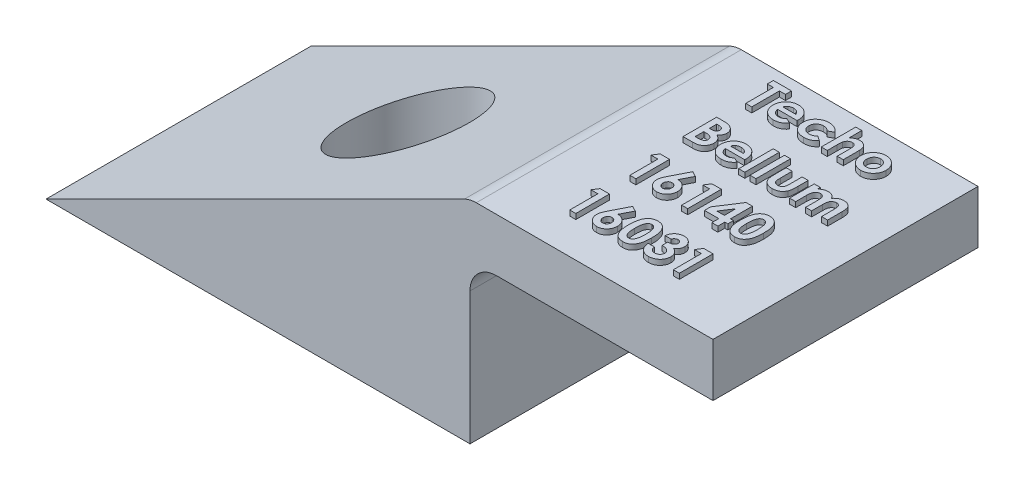
from build123d import *

# Parameters (mm, degrees)
BOSS_EXTRUDE1_DEPTH = 50
SKETCH3_W           = 1.13974359
SKETCH3_H           = 6.512820513
SKETCH3_W_2         = 1.139743589
BOSS_EXTRUDE3_DEPTH = 1
FILLET2_R           = 5
SKETCH5_R           = 11.61152453
CUT_EXTRUDE1_DEPTH  = 62


with BuildPart() as part:
    # Sketch1 → Boss-Extrude1 (new body)
    with BuildSketch(Plane.XY):
        Polygon((-80, 0), (0, 40), (45.844979967, 40), (45.844979967, 29.9910195), (0, 29.9910195), (0, 0), align=None)
    extrude(amount=BOSS_EXTRUDE1_DEPTH)

    # Sketch3 → Boss-Extrude3 (add)
    # profile 1 of 21: a face of its own
    with BuildSketch(Plane(origin=(0, 40, 0), x_dir=(1, 0, 0), z_dir=(0, 1, 0))):
        Polygon((10.232131162, -2.99765658), (13.651361931, -2.99765658), (13.651361931, -4.13740017), (12.511618341, -4.13740017), (12.511618341, -9.34765658), (11.371874752, -9.34765658), (11.371874752, -4.13740017), (10.232131162, -4.13740017), align=None)
    # profile 2 of 21: a face of its own
    with BuildSketch(Plane(origin=(0, 40, 0), x_dir=(1, 0, 0), z_dir=(0, 1, 0))):
        with BuildLine():
            Line((19.020622748, -7.31240017), (15.360977316, -7.31240017))
            add(Edge.make_bspline(
                [(15.360977316, -7.31240017), (15.368439037, -7.354923174), (15.383101909, -7.438484231), (15.414942855, -7.559863917), (15.455576679, -7.674250085), (15.504273757, -7.78179564), (15.560213058, -7.883069134), (15.625461619, -7.977595555), (15.69919182, -8.06529141), (15.780977373, -8.145775564), (15.869455062, -8.21789111), (15.964195803, -8.281068888), (16.065297361, -8.3328708), (16.171600646, -8.376534437), (16.283899988, -8.411120461), (16.402360663, -8.434973784), (16.526668651, -8.44906403), (16.611351049, -8.451102022), (16.654637171, -8.45214376)],
                knots=[0, 0, 0, 0, 1.091296461, 2.144483647, 3.168565212, 4.157007626, 5.126487748, 6.090021542, 7.05641414, 8.019231907, 8.98705074, 9.938580405, 10.892824166, 11.854447369, 12.841318655, 13.858982407, 14.905600794, 16, 16, 16, 16], degree=3))
            add(Edge.make_bspline(
                [(16.654637171, -8.45214376), (16.70688646, -8.450764328), (16.809780695, -8.448047821), (16.960521516, -8.423956436), (17.106309849, -8.387567459), (17.24576602, -8.333453996), (17.380505412, -8.266092246), (17.508309801, -8.182167795), (17.63139138, -8.084133189), (17.706485647, -8.008568152), (17.744771386, -7.970042397)],
                knots=[0, 0, 0, 0, 1.021034703, 2.010718019, 2.977989445, 3.954245119, 4.929443971, 5.918328161, 6.938689359, 8, 8, 8, 8], degree=3))
            Line((17.744771386, -7.970042397), (18.698797829, -8.424158984))
            add(Edge.make_bspline(
                [(18.698797829, -8.424158984), (18.668760863, -8.465665461), (18.60924372, -8.547909018), (18.512083981, -8.663646944), (18.410691607, -8.771635124), (18.30499098, -8.871163303), (18.194848043, -8.961947866), (18.08056919, -9.045094733), (17.96048428, -9.118371443), (17.83699439, -9.18532308), (17.707546756, -9.242720408), (17.572499615, -9.291666823), (17.432424969, -9.335913966), (17.285553978, -9.369627865), (17.133109634, -9.396315512), (16.974727262, -9.415267277), (16.810427735, -9.426972874), (16.698754303, -9.428360559), (16.641916819, -9.429066837)],
                knots=[0, 0, 0, 0, 1.028154879, 2.037251081, 3.030720504, 4.000128189, 4.949298328, 5.894184978, 6.834267904, 7.770992897, 8.712077017, 9.673380525, 10.653304757, 11.658697181, 12.695551717, 13.758623199, 14.859225354, 16, 16, 16, 16], degree=3))
            add(Edge.make_bspline(
                [(16.641916819, -9.429066837), (16.554473282, -9.427284126), (16.383220156, -9.42379279), (16.1327315, -9.391388195), (15.894836753, -9.337657883), (15.668864182, -9.264619777), (15.455790592, -9.168186596), (15.255510532, -9.050240815), (15.066022918, -8.913043693), (14.893117654, -8.753715826), (14.735595857, -8.580296914), (14.597238504, -8.394056846), (14.481463042, -8.196296809), (14.386385904, -7.988325621), (14.312488649, -7.769610957), (14.259213015, -7.540057376), (14.226554413, -7.299774514), (14.223027122, -7.136115063), (14.221233726, -7.052904978)],
                knots=[0, 0, 0, 0, 1.103565453, 2.161269334, 3.182010356, 4.179077853, 5.15417608, 6.128274628, 7.109042802, 8.101804412, 9.090965879, 10.063106201, 11.02526161, 11.978650795, 12.945248442, 13.93468508, 14.949922959, 16, 16, 16, 16], degree=3))
            add(Edge.make_bspline(
                [(14.221233726, -7.052904978), (14.223044773, -6.967580417), (14.226607926, -6.799708175), (14.258931825, -6.553877072), (14.312635938, -6.319320951), (14.386749358, -6.095716801), (14.480384165, -5.882365286), (14.597632671, -5.681132974), (14.735527197, -5.491319286), (14.892481525, -5.313812188), (15.066119269, -5.153592639), (15.250625778, -5.010805003), (15.448074169, -4.891824866), (15.656231133, -4.795688989), (15.873765223, -4.717581016), (16.103190827, -4.665606683), (16.342762368, -4.63070903), (16.506528197, -4.627495174), (16.589763373, -4.625861708)],
                knots=[0, 0, 0, 0, 1.079208495, 2.12329425, 3.130605359, 4.119693003, 5.099659317, 6.073216462, 7.060498243, 8.06384408, 9.066070512, 10.045757761, 11.010926815, 11.975797609, 12.942977511, 13.929384301, 14.947594487, 16, 16, 16, 16], degree=3))
            add(Edge.make_bspline(
                [(16.589763373, -4.625861708), (16.677625824, -4.627672076), (16.850134691, -4.631226547), (17.102367922, -4.663368025), (17.341842262, -4.717425977), (17.569578004, -4.789832536), (17.78266687, -4.888701721), (17.985791068, -5.003745043), (18.174078528, -5.143907785), (18.349536194, -5.302455953), (18.507922597, -5.478359651), (18.646369862, -5.669444942), (18.764171445, -5.873846947), (18.859650797, -6.092394558), (18.933472173, -6.324431675), (18.986797123, -6.569656952), (19.019206618, -6.829003107), (19.022668274, -7.006592284), (19.024438854, -7.097426212)],
                knots=[0, 0, 0, 0, 1.080001299, 2.120471247, 3.119684163, 4.095710327, 5.052285597, 6.002875087, 6.961153713, 7.931888285, 8.906493152, 9.865905668, 10.82813294, 11.801621613, 12.7925306, 13.817193356, 14.883530496, 16, 16, 16, 16], degree=3))
            Line((19.024438854, -7.097426212), (19.020622748, -7.31240017))
        make_face()
        with BuildLine():
            add(Edge.make_bspline(
                [(17.884695264, -6.416887349), (17.863187606, -6.358846891), (17.820424778, -6.24344734), (17.723825329, -6.084224118), (17.595640951, -5.946330341), (17.446553323, -5.824251887), (17.276211373, -5.725165388), (17.089982874, -5.653423545), (16.890221719, -5.610406235), (16.752796809, -5.605361061), (16.682621947, -5.602784785)],
                knots=[0, 0, 0, 0, 0.954238005, 1.897273737, 2.851915805, 3.847685534, 4.862635127, 5.880135777, 6.917509367, 8, 8, 8, 8], degree=3))
            add(Edge.make_bspline(
                [(16.682621947, -5.602784785), (16.605979573, -5.605259612), (16.45615969, -5.610097382), (16.240054708, -5.661548843), (16.036208287, -5.738338612), (15.916031991, -5.817510494), (15.85579903, -5.857191837)],
                knots=[0, 0, 0, 0, 1.044195649, 2.041185066, 3.018232172, 4, 4, 4, 4], degree=3))
            add(Edge.make_bspline(
                [(15.85579903, -5.857191837), (15.818218162, -5.887414016), (15.738097671, -5.951846159), (15.63404496, -6.080382166), (15.531552172, -6.236010416), (15.473279372, -6.354221066), (15.442387572, -6.416887349)],
                knots=[0, 0, 0, 0, 0.82159062, 1.751589201, 2.808063854, 4, 4, 4, 4], degree=3))
            Line((15.442387572, -6.416887349), (17.884695264, -6.416887349))
        make_face(mode=Mode.SUBTRACT)
    # profile 3 of 21: a face of its own
    with BuildSketch(Plane(origin=(0, 40, 0), x_dir=(1, 0, 0), z_dir=(0, 1, 0))):
        with BuildLine():
            Line((24.478926034, -5.653666195), (23.535075873, -6.17265658))
            add(Edge.make_bspline(
                [(23.535075873, -6.17265658), (23.491813222, -6.129332846), (23.40865153, -6.046053738), (23.275295072, -5.9406356), (23.144321519, -5.853352314), (23.010331374, -5.788941732), (22.872126923, -5.74043439), (22.724723299, -5.708306912), (22.566400044, -5.687152109), (22.456887668, -5.685201053), (22.400420425, -5.684195042)],
                knots=[0, 0, 0, 0, 1.150764855, 2.212059359, 3.192108068, 4.105322427, 5.000809612, 5.941206042, 6.938435785, 8, 8, 8, 8], degree=3))
            add(Edge.make_bspline(
                [(22.400420425, -5.684195042), (22.348636065, -5.685445825), (22.247298417, -5.687893503), (22.099228031, -5.706175981), (21.958502303, -5.734890782), (21.825373842, -5.776900636), (21.700079764, -5.83239794), (21.581583941, -5.898070652), (21.47103784, -5.976483858), (21.370004061, -6.066522936), (21.278803317, -6.165653964), (21.197447601, -6.271381466), (21.130798057, -6.385273885), (21.073175392, -6.504654334), (21.030810506, -6.631765047), (20.999815325, -6.765452625), (20.98214836, -6.905722992), (20.979588729, -7.001551617), (20.978285008, -7.050360907)],
                knots=[0, 0, 0, 0, 1.121765476, 2.195200973, 3.227634963, 4.230038321, 5.213228299, 6.192116585, 7.160777141, 8.14345191, 9.118668839, 10.075979138, 11.027630062, 11.972829041, 12.943187208, 13.923755399, 14.94248691, 16, 16, 16, 16], degree=3))
            add(Edge.make_bspline(
                [(20.978285008, -7.050360907), (20.979662501, -7.097896435), (20.982352155, -7.190712922), (20.998876479, -7.327082459), (21.027563329, -7.45690044), (21.070575505, -7.579480553), (21.122130406, -7.695952815), (21.186873924, -7.805390898), (21.263008734, -7.90827269), (21.350935655, -8.003703999), (21.448336372, -8.089532752), (21.553341981, -8.165328428), (21.66563919, -8.229589138), (21.786536148, -8.280019353), (21.914061754, -8.321109429), (22.049067626, -8.350367171), (22.191410097, -8.366607242), (22.288441356, -8.369336821), (22.338090697, -8.370733503)],
                knots=[0, 0, 0, 0, 1.070556293, 2.090336998, 3.088792742, 4.058148387, 5.011235098, 5.952916408, 6.915475435, 7.888633318, 8.869583867, 9.83422472, 10.800707077, 11.776204622, 12.778807041, 13.814557445, 14.881744048, 16, 16, 16, 16], degree=3))
            add(Edge.make_bspline(
                [(22.338090697, -8.370733503), (22.399220936, -8.369334665), (22.518538278, -8.366604335), (22.691991068, -8.343446556), (22.855207769, -8.305151733), (23.008205691, -8.252148656), (23.150770787, -8.182846146), (23.282536746, -8.0981983), (23.404858119, -7.998829553), (23.476189205, -7.921359439), (23.512179239, -7.882271965)],
                knots=[0, 0, 0, 0, 1.116373375, 2.178998604, 3.189797796, 4.174590301, 5.13072713, 6.078291395, 7.030403691, 8, 8, 8, 8], degree=3))
            Line((23.512179239, -7.882271965), (24.397515777, -8.490304817))
            add(Edge.make_bspline(
                [(24.397515777, -8.490304817), (24.336148501, -8.565334073), (24.215044847, -8.713398603), (24.003752554, -8.904248378), (23.776338227, -9.068230742), (23.528228073, -9.199119386), (23.263035396, -9.30322457), (22.97868797, -9.3768166), (22.675666749, -9.420137092), (22.467557106, -9.426042677), (22.360987332, -9.429066837)],
                knots=[0, 0, 0, 0, 0.997876357, 1.969233105, 2.924898516, 3.881013542, 4.852507933, 5.855329832, 6.901747111, 8, 8, 8, 8], degree=3))
            add(Edge.make_bspline(
                [(22.360987332, -9.429066837), (22.265067925, -9.426849464), (22.077726748, -9.422518692), (21.804681636, -9.389353149), (21.547868531, -9.333490305), (21.306759127, -9.255908297), (21.081573247, -9.155410545), (20.873041188, -9.030755783), (20.679756407, -8.885411452), (20.505206535, -8.71869095), (20.349467998, -8.537213884), (20.213507695, -8.34608968), (20.095923005, -8.148742726), (20.003677931, -7.941888259), (19.928288282, -7.728750456), (19.877372479, -7.50678156), (19.843790371, -7.277809955), (19.840305152, -7.122564427), (19.838541418, -7.044000731)],
                knots=[0, 0, 0, 0, 1.183377041, 2.311265848, 3.387807024, 4.421911742, 5.431260577, 6.423665966, 7.413571885, 8.409103097, 9.395976332, 10.359992013, 11.300391101, 12.225292883, 13.150239058, 14.085544813, 15.031169026, 16, 16, 16, 16], degree=3))
            add(Edge.make_bspline(
                [(19.838541418, -7.044000731), (19.839486263, -6.989264737), (19.84135771, -6.880849564), (19.85733395, -6.719840941), (19.882187611, -6.56156457), (19.919539729, -6.407131468), (19.96547624, -6.255792383), (20.021318289, -6.107577734), (20.089268494, -5.963252336), (20.165067153, -5.821588469), (20.251456515, -5.686325852), (20.345705518, -5.557524181), (20.447681371, -5.435972308), (20.558582034, -5.322803063), (20.677634238, -5.217206675), (20.803107271, -5.117040789), (20.93906138, -5.02747119), (21.080770275, -4.943259222), (21.229454632, -4.868294352), (21.383405528, -4.803589785), (21.541433266, -4.748613924), (21.70391663, -4.704412222), (21.87015821, -4.667981916), (22.041637261, -4.644861747), (22.216935083, -4.628611075), (22.335508036, -4.626783689), (22.395332284, -4.625861708)],
                knots=[0, 0, 0, 0, 1.00272354, 1.986087015, 2.96193297, 3.936200312, 4.894695956, 5.858592327, 6.835334787, 7.815655071, 8.800643866, 9.773423113, 10.738352213, 11.705312252, 12.673769326, 13.65298065, 14.64420052, 15.654211674, 16.672258995, 17.692438602, 18.712115155, 19.735602823, 20.776372304, 21.827874031, 22.90408564, 24, 24, 24, 24], degree=3))
            add(Edge.make_bspline(
                [(22.395332284, -4.625861708), (22.450901335, -4.626489964), (22.560495253, -4.627729016), (22.722340697, -4.640685032), (22.879771326, -4.662691394), (23.033055059, -4.691804885), (23.182657414, -4.727881569), (23.326573325, -4.775970581), (23.466770363, -4.830549799), (23.64734563, -4.912958719), (23.860210819, -5.035967371), (24.093879767, -5.212388894), (24.302223921, -5.418776345), (24.419712266, -5.574953423), (24.478926034, -5.653666195)],
                knots=[0, 0, 0, 0, 0.826738014, 1.630502179, 2.413926014, 3.191023582, 3.95155221, 4.701751672, 5.446919844, 6.189438973, 7.653650558, 9.094719814, 10.535747635, 12, 12, 12, 12], degree=3))
        make_face()
    # profile 4 of 21: a face of its own
    with BuildSketch(Plane(origin=(0, 40, 0), x_dir=(1, 0, 0), z_dir=(0, 1, 0))):
        with BuildLine():
            Line((25.618669623, -2.834836067), (26.758413213, -2.834836067))
            Line((26.758413213, -2.834836067), (26.758413213, -5.209725891))
            add(Edge.make_bspline(
                [(26.758413213, -5.209725891), (26.815824513, -5.16303563), (26.927729086, -5.072028222), (27.103311029, -4.953467163), (27.278529803, -4.852293795), (27.455244736, -4.770299698), (27.632689175, -4.706045725), (27.811169538, -4.66047788), (27.990857645, -4.630581352), (28.111317867, -4.627436601), (28.171644383, -4.625861708)],
                knots=[0, 0, 0, 0, 1.13710654, 2.216417683, 3.252896077, 4.244436563, 5.207303112, 6.149540546, 7.073289332, 8, 8, 8, 8], degree=3))
            add(Edge.make_bspline(
                [(28.171644383, -4.625861708), (28.22937281, -4.627393484), (28.34269856, -4.63040049), (28.508954306, -4.652120516), (28.668194109, -4.68949508), (28.82081025, -4.740872899), (28.965752757, -4.809968496), (29.104906447, -4.890905264), (29.236617293, -4.987875083), (29.316755841, -5.062624149), (29.357181242, -5.100330859)],
                knots=[0, 0, 0, 0, 1.056403236, 2.073808271, 3.062028718, 4.046096703, 5.014652014, 5.995532726, 6.988858718, 8, 8, 8, 8], degree=3))
            add(Edge.make_bspline(
                [(29.357181242, -5.100330859), (29.390381168, -5.135564326), (29.457262717, -5.206542463), (29.540561902, -5.328907131), (29.612489916, -5.46219262), (29.671100994, -5.607651402), (29.714690953, -5.765351187), (29.748438421, -5.933992823), (29.767101488, -6.115417682), (29.769404769, -6.240457948), (29.7705927, -6.304948247)],
                knots=[0, 0, 0, 0, 0.887296576, 1.787466942, 2.706642908, 3.663267187, 4.658426068, 5.705361056, 6.816525637, 8, 8, 8, 8], degree=3))
            Line((29.7705927, -6.304948247), (29.7705927, -9.34765658))
            Line((29.7705927, -9.34765658), (28.630849111, -9.34765658))
            Line((28.630849111, -9.34765658), (28.630849111, -7.330208663))
            add(Edge.make_bspline(
                [(28.630849111, -7.330208663), (28.630627656, -7.266180957), (28.630203769, -7.143625322), (28.626397255, -6.967632212), (28.620181099, -6.8077492), (28.611680222, -6.663927969), (28.599811141, -6.536769571), (28.588137065, -6.425362583), (28.571755601, -6.33024102), (28.547226435, -6.226882402), (28.507307386, -6.116332018), (28.449298511, -5.998490061), (28.371814593, -5.901234228), (28.28214612, -5.821022548), (28.178468404, -5.75980196), (28.064493008, -5.714585496), (27.938271458, -5.689156875), (27.850780359, -5.685892186), (27.805298229, -5.684195042)],
                knots=[0, 0, 0, 0, 1.461461505, 2.797388094, 4.017818807, 5.113567707, 6.085313608, 6.932873269, 7.669572396, 8.286941306, 9.355291607, 10.346554054, 11.270113241, 12.175128673, 13.078071705, 14.003657132, 14.962203834, 16, 16, 16, 16], degree=3))
            add(Edge.make_bspline(
                [(27.805298229, -5.684195042), (27.746048488, -5.686511309), (27.63000119, -5.69104798), (27.463584232, -5.737747583), (27.310086481, -5.811562234), (27.1712994, -5.913866019), (27.050361187, -6.042005583), (26.949033628, -6.192197949), (26.866153232, -6.362940869), (26.830330833, -6.487449557), (26.811838694, -6.551723087)],
                knots=[0, 0, 0, 0, 0.993549393, 1.945978497, 2.879753144, 3.843180486, 4.826017097, 5.826060929, 6.877775219, 8, 8, 8, 8], degree=3))
            add(Edge.make_bspline(
                [(26.811838694, -6.551723087), (26.807234112, -6.571589099), (26.796734158, -6.616890109), (26.788693095, -6.694181413), (26.776760284, -6.787613355), (26.772620984, -6.897745829), (26.764867093, -7.024408968), (26.762078489, -7.167807705), (26.759271073, -7.328076853), (26.758708359, -7.440449516), (26.758413213, -7.499389353)],
                knots=[0, 0, 0, 0, 0.514379255, 1.17295301, 1.959069106, 2.891908278, 3.953016936, 5.163065833, 6.51201855, 8, 8, 8, 8], degree=3))
            Line((26.758413213, -7.499389353), (26.758413213, -9.34765658))
            Line((26.758413213, -9.34765658), (25.618669623, -9.34765658))
            Line((25.618669623, -9.34765658), (25.618669623, -2.834836067))
        make_face()
    # profile 5 of 21: a face of its own
    with BuildSketch(Plane(origin=(0, 40, 0), x_dir=(1, 0, 0), z_dir=(0, 1, 0))):
        with BuildLine():
            add(Edge.make_bspline(
                [(33.121133566, -4.625861708), (33.175018442, -4.626820627), (33.281734914, -4.628719719), (33.440675768, -4.644527931), (33.596837969, -4.670319681), (33.751119117, -4.703715495), (33.902086568, -4.750508025), (34.050532126, -4.806628429), (34.197783085, -4.871061217), (34.340184705, -4.947758771), (34.47876573, -5.030944263), (34.61014879, -5.122704686), (34.733242838, -5.222319294), (34.850332919, -5.327478443), (34.955962447, -5.442760418), (35.056881714, -5.562610453), (35.147638298, -5.691322354), (35.231665822, -5.82575971), (35.306474922, -5.965145097), (35.371432868, -6.108508899), (35.427810257, -6.253869012), (35.471952623, -6.402996021), (35.508498433, -6.553923488), (35.531561437, -6.708500916), (35.547957634, -6.865140406), (35.549796167, -6.970603002), (35.550720905, -7.023648167)],
                knots=[0, 0, 0, 0, 1.022364134, 2.024744242, 3.027414945, 4.024939316, 5.017584196, 6.023349371, 7.035562955, 8.064994934, 9.090267829, 10.101425541, 11.102933353, 12.093946398, 13.084502048, 14.067315274, 15.065326281, 16.070028806, 17.074376865, 18.064572984, 19.055292013, 20.030201733, 21.013838017, 21.999348303, 22.993720005, 24, 24, 24, 24], degree=3))
            add(Edge.make_bspline(
                [(35.550720905, -7.023648167), (35.549744997, -7.077107747), (35.547804671, -7.183397512), (35.532154631, -7.341510391), (35.506264159, -7.496814724), (35.472740171, -7.650225437), (35.426122751, -7.799779492), (35.371655273, -7.947681376), (35.3047943, -8.091915129), (35.230874569, -8.234054207), (35.146306783, -8.369915891), (35.055628759, -8.499917175), (34.955132191, -8.620647514), (34.850348257, -8.735851092), (34.736306819, -8.841632241), (34.614828189, -8.939708563), (34.486964036, -9.031279085), (34.351794881, -9.114195391), (34.211052016, -9.187050993), (34.067109043, -9.252736263), (33.919124263, -9.30742394), (33.767403939, -9.352020235), (33.611856057, -9.38655003), (33.452824027, -9.410006531), (33.290650346, -9.426320256), (33.181384105, -9.428145416), (33.126221707, -9.429066837)],
                knots=[0, 0, 0, 0, 1.012026251, 2.012137606, 3.004615893, 3.992048833, 4.982446996, 5.968083444, 6.973977695, 7.990229942, 8.999482246, 10.001782172, 10.988562221, 11.971415814, 12.948383116, 13.930088534, 14.925840678, 15.924049238, 16.929462851, 17.924729459, 18.917889337, 19.913673841, 20.916777188, 21.931792057, 22.95587778, 24, 24, 24, 24], degree=3))
            add(Edge.make_bspline(
                [(33.126221707, -9.429066837), (33.045563032, -9.426699345), (32.886583557, -9.422032984), (32.652444376, -9.390069632), (32.427513915, -9.335052321), (32.21142565, -9.258359404), (32.003898879, -9.160080289), (31.806744728, -9.038444959), (31.618002053, -8.895848066), (31.440940017, -8.733494851), (31.278727206, -8.555378673), (31.137014799, -8.365240738), (31.016689497, -8.165930894), (30.917859557, -7.957221862), (30.841582997, -7.738827443), (30.786498306, -7.511400563), (30.754495874, -7.274301955), (30.74986898, -7.113210322), (30.747515777, -7.031280378)],
                knots=[0, 0, 0, 0, 1.029999031, 2.030143771, 3.011211297, 3.982305373, 4.953580601, 5.938004764, 6.935448627, 7.970290061, 9.001484052, 10.007591832, 10.993831261, 11.969999897, 12.951306496, 13.942897864, 14.953773953, 16, 16, 16, 16], degree=3))
            add(Edge.make_bspline(
                [(30.747515777, -7.031280378), (30.749951043, -6.943797158), (30.754737509, -6.771850641), (30.792744155, -6.519945074), (30.853436668, -6.278757433), (30.940556947, -6.048962394), (31.051845442, -5.830136133), (31.187703473, -5.622740178), (31.348802458, -5.426727551), (31.472172022, -5.308172395), (31.534905601, -5.247886949)],
                knots=[0, 0, 0, 0, 1.043912699, 2.05178951, 3.033892, 4.007821512, 4.978932272, 5.95884105, 6.962068106, 8, 8, 8, 8], degree=3))
            add(Edge.make_bspline(
                [(31.534905601, -5.247886949), (31.59246993, -5.197917095), (31.706032435, -5.099336918), (31.890534128, -4.974304124), (32.079443044, -4.866313936), (32.275023335, -4.777525916), (32.477820229, -4.710581182), (32.686794507, -4.661851405), (32.901902717, -4.631920148), (33.047685248, -4.627891451), (33.121133566, -4.625861708)],
                knots=[0, 0, 0, 0, 1.048115528, 2.067714963, 3.060638214, 4.039924844, 5.017819947, 5.994373833, 6.98952318, 8, 8, 8, 8], degree=3))
        make_face()
        with BuildLine():
            add(Edge.make_bspline(
                [(33.146574271, -5.684195042), (33.102446527, -5.685661702), (33.015580587, -5.688548838), (32.887711643, -5.704043326), (32.766771848, -5.735800611), (32.650359114, -5.776187185), (32.540532793, -5.830198538), (32.434285134, -5.893404268), (32.33714078, -5.972498462), (32.244398607, -6.059259006), (32.160209386, -6.155604261), (32.088472175, -6.260572345), (32.024373388, -6.370147398), (31.975770528, -6.4883411), (31.935547015, -6.611922873), (31.908324224, -6.742889424), (31.889379063, -6.879777784), (31.887972653, -6.973547249), (31.887259367, -7.021104096)],
                knots=[0, 0, 0, 0, 1.030650113, 2.02884584, 2.99876339, 3.944280128, 4.900564847, 5.851248946, 6.823638398, 7.81794922, 8.81432732, 9.802856497, 10.78262424, 11.771747962, 12.779760563, 13.812642396, 14.89064281, 16, 16, 16, 16], degree=3))
            add(Edge.make_bspline(
                [(31.887259367, -7.021104096), (31.888094008, -7.070338037), (31.889725154, -7.166556319), (31.906616013, -7.307047949), (31.934469595, -7.440373575), (31.974040807, -7.566327238), (32.023808287, -7.685813016), (32.084867213, -7.798160515), (32.157861995, -7.902694232), (32.240620361, -7.999285442), (32.331237237, -8.086962352), (32.430528126, -8.162203395), (32.534335099, -8.227577876), (32.645050431, -8.280083674), (32.761101648, -8.32062241), (32.882833259, -8.350469718), (33.010884962, -8.36655), (33.098195987, -8.369319827), (33.142758165, -8.370733503)],
                knots=[0, 0, 0, 0, 1.141730614, 2.231293227, 3.276944405, 4.297399982, 5.28939179, 6.275415646, 7.257752684, 8.24146775, 9.222424823, 10.176631434, 11.126518621, 12.063689483, 13.012557477, 13.974037417, 14.965980454, 16, 16, 16, 16], degree=3))
            add(Edge.make_bspline(
                [(33.142758165, -8.370733503), (33.187342631, -8.369479636), (33.274754067, -8.367021329), (33.402956143, -8.348612493), (33.525309404, -8.319640613), (33.64235179, -8.278752974), (33.753137001, -8.225123317), (33.858089133, -8.159436076), (33.958131464, -8.083148498), (34.049964427, -7.993817291), (34.134972445, -7.896924848), (34.209519392, -7.791839305), (34.271813633, -7.679491777), (34.322906064, -7.560589157), (34.362554849, -7.435294874), (34.38994731, -7.303143227), (34.408902601, -7.164543762), (34.410277203, -7.069507813), (34.410977316, -7.021104096)],
                knots=[0, 0, 0, 0, 1.031504075, 2.022346795, 2.991027682, 3.937587355, 4.885570121, 5.833146507, 6.798790848, 7.791235734, 8.792807298, 9.778388351, 10.766749885, 11.760164525, 12.768777521, 13.802286646, 14.880660483, 16, 16, 16, 16], degree=3))
            add(Edge.make_bspline(
                [(34.410977316, -7.021104096), (34.410132057, -6.972717297), (34.408473385, -6.877766701), (34.391581322, -6.738979782), (34.364001087, -6.607255286), (34.323919494, -6.483155664), (34.274447825, -6.365265137), (34.213346695, -6.254187143), (34.139991926, -6.150468769), (34.056831248, -6.054624307), (33.964855969, -5.968177704), (33.867289009, -5.891088319), (33.761899314, -5.827329475), (33.650664057, -5.774769427), (33.533287293, -5.734331974), (33.409900799, -5.704315513), (33.280126432, -5.688464046), (33.191556918, -5.685632915), (33.146574271, -5.684195042)],
                knots=[0, 0, 0, 0, 1.123894411, 2.205445421, 3.243160173, 4.246488011, 5.231014757, 6.210004299, 7.185865357, 8.177612767, 9.153374344, 10.115157457, 11.061423229, 12.009021698, 12.96873347, 13.94135618, 14.954456845, 16, 16, 16, 16], degree=3))
        make_face(mode=Mode.SUBTRACT)
    # profile 6 of 21: a face of its own
    with BuildSketch(Plane(origin=(0, 40, 0), x_dir=(1, 0, 0), z_dir=(0, 1, 0))):
        with BuildLine():
            Line((10.883413213, -20.686759144), (10.883413213, -14.336759144))
            Line((10.883413213, -14.336759144), (11.901041418, -14.336759144))
            add(Edge.make_bspline(
                [(11.901041418, -14.336759144), (11.972281756, -14.336751014), (12.110130458, -14.336735282), (12.30901016, -14.343719284), (12.493454287, -14.352753873), (12.662875868, -14.362861478), (12.817563269, -14.3802789), (12.957281262, -14.39863496), (13.082309006, -14.420771237), (13.159606866, -14.440628163), (13.195973309, -14.449970282)],
                knots=[0, 0, 0, 0, 1.311965854, 2.538629056, 3.664479157, 4.713267157, 5.663616078, 6.530575999, 7.308677837, 8, 8, 8, 8], degree=3))
            add(Edge.make_bspline(
                [(13.195973309, -14.449970282), (13.243726141, -14.463147507), (13.337432527, -14.489005452), (13.471649975, -14.54122669), (13.598973947, -14.599274298), (13.719248984, -14.665495762), (13.831736548, -14.740690561), (13.93600915, -14.825455464), (14.03431569, -14.91638801), (14.123165529, -15.016022464), (14.203471144, -15.121304722), (14.273242325, -15.232207195), (14.333864539, -15.347034113), (14.382378189, -15.467230497), (14.418932313, -15.592242808), (14.445667846, -15.721537227), (14.462996093, -15.855522871), (14.464633385, -15.946677684), (14.465464495, -15.992949048)],
                knots=[0, 0, 0, 0, 1.099996261, 2.158545794, 3.195537121, 4.207578794, 5.205712374, 6.197378256, 7.190519799, 8.17788031, 9.159561366, 10.129234751, 11.085776129, 12.040971148, 13.00380137, 13.975669004, 14.972423361, 16, 16, 16, 16], degree=3))
            add(Edge.make_bspline(
                [(14.465464495, -15.992949048), (14.463291388, -16.052395605), (14.459013893, -16.169408849), (14.431688964, -16.341280134), (14.380450466, -16.503723203), (14.313406138, -16.659731818), (14.222246811, -16.808724068), (14.106492098, -16.95062911), (13.968016843, -17.089816414), (13.861798679, -17.173249814), (13.806550232, -17.216646965)],
                knots=[0, 0, 0, 0, 0.986156485, 1.941127874, 2.875419072, 3.804401753, 4.751181392, 5.761612777, 6.835722519, 8, 8, 8, 8], degree=3))
            add(Edge.make_bspline(
                [(13.806550232, -17.216646965), (13.851320923, -17.239502014), (13.939103861, -17.284314442), (14.063729843, -17.357972698), (14.179119899, -17.436317594), (14.285791402, -17.5177728), (14.381506795, -17.605791321), (14.470218329, -17.695301408), (14.547549435, -17.791431617), (14.616701241, -17.890755685), (14.676806867, -17.994711835), (14.72915224, -18.103124509), (14.773366498, -18.216364068), (14.810808275, -18.333854215), (14.838732363, -18.45599906), (14.856939462, -18.582842288), (14.870879955, -18.713951299), (14.871964394, -18.803259483), (14.872515777, -18.848668199)],
                knots=[0, 0, 0, 0, 1.164658916, 2.283573913, 3.35186032, 4.395461096, 5.390182219, 6.362969632, 7.312859996, 8.245001507, 9.165155236, 10.092416118, 11.032087915, 11.979892451, 12.947605196, 13.931445124, 14.948243989, 16, 16, 16, 16], degree=3))
            add(Edge.make_bspline(
                [(14.872515777, -18.848668199), (14.868937671, -18.935396249), (14.861876294, -19.106553708), (14.810246946, -19.357852166), (14.720738062, -19.596105898), (14.600546088, -19.82036798), (14.452446452, -20.024146393), (14.28217434, -20.202654515), (14.091444002, -20.353757676), (13.915472213, -20.455740588), (13.763270473, -20.524180659), (13.637204615, -20.566494626), (13.501812557, -20.605694222), (13.354614239, -20.633220987), (13.198278168, -20.65841651), (13.031280056, -20.673972747), (12.853932021, -20.684514826), (12.732121723, -20.685995914), (12.669350713, -20.686759144)],
                knots=[0, 0, 0, 0, 1.284142165, 2.534249414, 3.780121997, 5.041676246, 6.291546858, 7.49970053, 8.684500223, 9.883330709, 10.50184324, 11.153274765, 11.851151195, 12.587658647, 13.369265475, 14.195992086, 15.070362669, 16, 16, 16, 16], degree=3))
            Line((12.669350713, -20.686759144), (10.883413213, -20.686759144))
        make_face()
        with BuildLine():
            Line((12.023156803, -15.476502734), (12.023156803, -16.860477093))
            Line((12.023156803, -16.860477093), (12.325901194, -16.860477093))
            add(Edge.make_bspline(
                [(12.325901194, -16.860477093), (12.367046877, -16.860118287), (12.446476127, -16.859425634), (12.561203254, -16.850504502), (12.667880955, -16.835284497), (12.766104623, -16.814048762), (12.856789248, -16.787082475), (12.939355511, -16.754636223), (13.013440382, -16.71504827), (13.099509868, -16.656080266), (13.190491521, -16.569306208), (13.270581647, -16.443943103), (13.317754196, -16.29977601), (13.323007946, -16.198098212), (13.325720905, -16.145593279)],
                knots=[0, 0, 0, 0, 1.065314748, 2.056525647, 2.977365736, 3.853934255, 4.656397591, 5.425096493, 6.14721249, 6.826394842, 8.123232004, 9.372140726, 10.643011755, 12, 12, 12, 12], degree=3))
            add(Edge.make_bspline(
                [(13.325720905, -16.145593279), (13.323550041, -16.096413685), (13.319352762, -16.001326917), (13.27185607, -15.867816626), (13.198084317, -15.749499184), (13.110986394, -15.668520571), (13.028966774, -15.613214566), (12.958736543, -15.576797917), (12.881653591, -15.544198104), (12.796225674, -15.519271493), (12.702940633, -15.500567442), (12.602251606, -15.486831556), (12.493984868, -15.477482328), (12.419204802, -15.476836269), (12.38059871, -15.476502734)],
                knots=[0, 0, 0, 0, 1.347982417, 2.606269829, 3.849316587, 5.153353503, 5.842674298, 6.568177932, 7.326619318, 8.142485038, 9.012069166, 9.942760135, 10.937925643, 12, 12, 12, 12], degree=3))
            Line((12.38059871, -15.476502734), (12.023156803, -15.476502734))
        make_face(mode=Mode.SUBTRACT)
        with BuildLine():
            Line((12.023156803, -17.918810426), (12.023156803, -19.547015554))
            Line((12.023156803, -19.547015554), (12.351341899, -19.547015554))
            add(Edge.make_bspline(
                [(12.351341899, -19.547015554), (12.41622451, -19.546644883), (12.540969427, -19.545932219), (12.719666299, -19.537321555), (12.88214643, -19.521802349), (13.027979309, -19.50242787), (13.157388306, -19.476178483), (13.269935989, -19.44280575), (13.367165802, -19.406089931), (13.448494751, -19.360741536), (13.514935843, -19.307967249), (13.574891963, -19.254030661), (13.623776447, -19.19180971), (13.662454763, -19.12397537), (13.695930777, -19.052212695), (13.716121145, -18.973719378), (13.731493382, -18.890821773), (13.732339358, -18.833483293), (13.732772187, -18.804146965)],
                knots=[0, 0, 0, 0, 1.753078804, 3.370512758, 4.83203934, 6.162291463, 7.344201807, 8.395507345, 9.331626367, 10.147333109, 10.898971645, 11.62040215, 12.321813352, 13.025280112, 13.727906689, 14.453419512, 15.208716525, 16, 16, 16, 16], degree=3))
            add(Edge.make_bspline(
                [(13.732772187, -18.804146965), (13.731817673, -18.770600412), (13.729958536, -18.705260753), (13.714774942, -18.609759868), (13.687181392, -18.520603455), (13.65242597, -18.435511664), (13.604061953, -18.357531079), (13.546582971, -18.283963087), (13.477133688, -18.217298926), (13.399033917, -18.153506501), (13.307938267, -18.097652776), (13.203803998, -18.049189776), (13.086065397, -18.008715263), (12.954357754, -17.97648943), (12.809258467, -17.94913981), (12.64970847, -17.932809068), (12.47703655, -17.920663177), (12.357303031, -17.919442043), (12.295372348, -17.918810426)],
                knots=[0, 0, 0, 0, 0.845221588, 1.646264278, 2.427170338, 3.19324141, 3.95557735, 4.731569926, 5.540061037, 6.376114724, 7.268642756, 8.224665384, 9.265483498, 10.400594375, 11.639216012, 12.983232105, 14.439614077, 16, 16, 16, 16], degree=3))
            Line((12.295372348, -17.918810426), (12.023156803, -17.918810426))
        make_face(mode=Mode.SUBTRACT)
    # profile 7 of 21: a face of its own
    with BuildSketch(Plane(origin=(0, 40, 0), x_dir=(1, 0, 0), z_dir=(0, 1, 0))):
        with BuildLine():
            Line((20.486007364, -18.651502734), (16.826361931, -18.651502734))
            add(Edge.make_bspline(
                [(16.826361931, -18.651502734), (16.833823653, -18.694025738), (16.848486524, -18.777586795), (16.880327471, -18.898966481), (16.920961294, -19.013352649), (16.969658373, -19.120898205), (17.025597674, -19.222171698), (17.090846234, -19.316698119), (17.164576435, -19.404393974), (17.246361989, -19.484878128), (17.334839677, -19.556993674), (17.429580418, -19.620171452), (17.530681976, -19.671973364), (17.636985262, -19.715637002), (17.749284604, -19.750223025), (17.867745279, -19.774076348), (17.992053266, -19.788166594), (18.076735664, -19.790204587), (18.120021787, -19.791246324)],
                knots=[0, 0, 0, 0, 1.091296461, 2.144483647, 3.168565212, 4.157007626, 5.126487748, 6.090021542, 7.05641414, 8.019231907, 8.98705074, 9.938580405, 10.892824166, 11.854447369, 12.841318655, 13.858982407, 14.905600794, 16, 16, 16, 16], degree=3))
            add(Edge.make_bspline(
                [(18.120021787, -19.791246324), (18.172271075, -19.789866892), (18.275165311, -19.787150385), (18.425906132, -19.763059), (18.571694464, -19.726670023), (18.711150636, -19.67255656), (18.845890028, -19.60519481), (18.973694417, -19.521270359), (19.096775995, -19.423235753), (19.171870262, -19.347670716), (19.210156002, -19.309144962)],
                knots=[0, 0, 0, 0, 1.021034703, 2.010718019, 2.977989445, 3.954245119, 4.929443971, 5.918328161, 6.938689359, 8, 8, 8, 8], degree=3))
            Line((19.210156002, -19.309144962), (20.164182444, -19.763261548))
            add(Edge.make_bspline(
                [(20.164182444, -19.763261548), (20.134145478, -19.804768025), (20.074628335, -19.887011582), (19.977468597, -20.002749508), (19.876076222, -20.110737688), (19.770375595, -20.210265867), (19.660232659, -20.301050431), (19.545953805, -20.384197297), (19.425868895, -20.457474007), (19.302379006, -20.524425644), (19.172931371, -20.581822972), (19.037884231, -20.630769387), (18.897809585, -20.67501653), (18.750938593, -20.708730429), (18.59849425, -20.735418076), (18.440111877, -20.754369841), (18.27581235, -20.766075439), (18.164138919, -20.767463123), (18.107301434, -20.768169401)],
                knots=[0, 0, 0, 0, 1.028154879, 2.037251081, 3.030720504, 4.000128189, 4.949298328, 5.894184978, 6.834267904, 7.770992897, 8.712077017, 9.673380525, 10.653304757, 11.658697181, 12.695551717, 13.758623199, 14.859225354, 16, 16, 16, 16], degree=3))
            add(Edge.make_bspline(
                [(18.107301434, -20.768169401), (18.019857898, -20.76638669), (17.848604771, -20.762895354), (17.598116115, -20.730490759), (17.360221368, -20.676760447), (17.134248798, -20.603722341), (16.921175208, -20.50728916), (16.720895148, -20.389343379), (16.531407533, -20.252146257), (16.358502269, -20.09281839), (16.200980472, -19.919399478), (16.06262312, -19.73315941), (15.946847657, -19.535399373), (15.851770519, -19.327428185), (15.777873265, -19.108713522), (15.724597631, -18.87915994), (15.691939029, -18.638877079), (15.688411737, -18.475217628), (15.686618341, -18.392007542)],
                knots=[0, 0, 0, 0, 1.103565453, 2.161269334, 3.182010356, 4.179077853, 5.15417608, 6.128274628, 7.109042802, 8.101804412, 9.090965879, 10.063106201, 11.02526161, 11.978650795, 12.945248442, 13.93468508, 14.949922959, 16, 16, 16, 16], degree=3))
            add(Edge.make_bspline(
                [(15.686618341, -18.392007542), (15.688429388, -18.306682981), (15.691992541, -18.138810739), (15.72431644, -17.892979637), (15.778020554, -17.658423515), (15.852133974, -17.434819365), (15.94576878, -17.22146785), (16.063017286, -17.020235538), (16.200911813, -16.83042185), (16.357866141, -16.652914752), (16.531503885, -16.492695203), (16.716010393, -16.349907567), (16.913458785, -16.23092743), (17.121615749, -16.134791553), (17.339149838, -16.05668358), (17.568575442, -16.004709247), (17.808146983, -15.969811594), (17.971912813, -15.966597738), (18.055147989, -15.964964272)],
                knots=[0, 0, 0, 0, 1.079208495, 2.12329425, 3.130605359, 4.119693003, 5.099659317, 6.073216462, 7.060498243, 8.06384408, 9.066070512, 10.045757761, 11.010926815, 11.975797609, 12.942977511, 13.929384301, 14.947594487, 16, 16, 16, 16], degree=3))
            add(Edge.make_bspline(
                [(18.055147989, -15.964964272), (18.143010439, -15.96677464), (18.315519306, -15.970329112), (18.567752538, -16.002470589), (18.807226877, -16.056528541), (19.03496262, -16.1289351), (19.248051485, -16.227804285), (19.451175684, -16.342847607), (19.639463144, -16.483010349), (19.81492081, -16.641558517), (19.973307212, -16.817462215), (20.111754477, -17.008547506), (20.22955606, -17.212949511), (20.325035412, -17.431497122), (20.398856788, -17.663534239), (20.452181739, -17.908759516), (20.484591233, -18.168105672), (20.48805289, -18.345694848), (20.48982347, -18.436528776)],
                knots=[0, 0, 0, 0, 1.080001299, 2.120471247, 3.119684163, 4.095710327, 5.052285597, 6.002875087, 6.961153713, 7.931888285, 8.906493152, 9.865905668, 10.82813294, 11.801621613, 12.7925306, 13.817193356, 14.883530496, 16, 16, 16, 16], degree=3))
            Line((20.48982347, -18.436528776), (20.486007364, -18.651502734))
        make_face()
        with BuildLine():
            add(Edge.make_bspline(
                [(19.35007988, -17.755989913), (19.328572221, -17.697949455), (19.285809393, -17.582549904), (19.189209944, -17.423326682), (19.061025566, -17.285432905), (18.911937938, -17.163354451), (18.741595989, -17.064267952), (18.55536749, -16.992526109), (18.355606335, -16.9495088), (18.218181424, -16.944463625), (18.148006562, -16.941887349)],
                knots=[0, 0, 0, 0, 0.954238005, 1.897273737, 2.851915805, 3.847685534, 4.862635127, 5.880135777, 6.917509367, 8, 8, 8, 8], degree=3))
            add(Edge.make_bspline(
                [(18.148006562, -16.941887349), (18.071364188, -16.944362176), (17.921544305, -16.949199946), (17.705439324, -17.000651407), (17.501592903, -17.077441176), (17.381416606, -17.156613058), (17.321183646, -17.196294401)],
                knots=[0, 0, 0, 0, 1.044195649, 2.041185066, 3.018232172, 4, 4, 4, 4], degree=3))
            add(Edge.make_bspline(
                [(17.321183646, -17.196294401), (17.283602777, -17.22651658), (17.203482287, -17.290948723), (17.099429575, -17.41948473), (16.996936788, -17.57511298), (16.938663988, -17.69332363), (16.907772187, -17.755989913)],
                knots=[0, 0, 0, 0, 0.82159062, 1.751589201, 2.808063854, 4, 4, 4, 4], degree=3))
            Line((16.907772187, -17.755989913), (19.35007988, -17.755989913))
        make_face(mode=Mode.SUBTRACT)
    # profile 8 of 21: a face of its own
    with BuildSketch(Plane(origin=(0, 40, 0), x_dir=(1, 0, 0), z_dir=(0, 1, 0))):
        with Locations((21.955208085, -17.430348887)):
            Rectangle(SKETCH3_W, SKETCH3_H)
    # profile 9 of 21: a face of its own
    with BuildSketch(Plane(origin=(0, 40, 0), x_dir=(1, 0, 0), z_dir=(0, 1, 0))):
        with Locations((24.071874752, -17.430348887)):
            Rectangle(SKETCH3_W_2, SKETCH3_H)
    # profile 10 of 21: a face of its own
    with BuildSketch(Plane(origin=(0, 40, 0), x_dir=(1, 0, 0), z_dir=(0, 1, 0))):
        with BuildLine():
            Line((25.70007988, -16.046374529), (26.83982347, -16.046374529))
            Line((26.83982347, -16.046374529), (26.83982347, -18.273708263))
            add(Edge.make_bspline(
                [(26.83982347, -18.273708263), (26.839924679, -18.325867043), (26.840118926, -18.425972478), (26.845524168, -18.569743482), (26.853108792, -18.701215482), (26.862573889, -18.820543507), (26.876701153, -18.927440534), (26.893010484, -19.021702493), (26.911500004, -19.104008553), (26.941566298, -19.19574963), (26.988605559, -19.296142594), (27.059643168, -19.402721515), (27.145690433, -19.494881119), (27.245584796, -19.573439274), (27.360346425, -19.635344824), (27.488394205, -19.677297272), (27.628117033, -19.705493678), (27.725433774, -19.708350456), (27.776041418, -19.709836067)],
                knots=[0, 0, 0, 0, 1.267339619, 2.432334223, 3.495366327, 4.467371443, 5.340232306, 6.114347373, 6.791623365, 7.387877112, 8.457231658, 9.474542289, 10.487879852, 11.508108106, 12.54995813, 13.638205937, 14.771795776, 16, 16, 16, 16], degree=3))
            add(Edge.make_bspline(
                [(27.776041418, -19.709836067), (27.826604152, -19.708140453), (27.924172571, -19.704868508), (28.064825029, -19.679353017), (28.193174412, -19.635631372), (28.310538948, -19.576328121), (28.41345755, -19.496960821), (28.503064569, -19.402389052), (28.578511575, -19.291087256), (28.614767341, -19.208059305), (28.633393181, -19.165404978)],
                knots=[0, 0, 0, 0, 1.116871431, 2.155171802, 3.144773418, 4.104381479, 5.046960687, 6.001340237, 6.973219418, 8, 8, 8, 8], degree=3))
            add(Edge.make_bspline(
                [(28.633393181, -19.165404978), (28.640228238, -19.146457543), (28.655315839, -19.104633266), (28.668744103, -19.032480633), (28.683196913, -18.947388284), (28.694629599, -18.84762211), (28.701098616, -18.733799972), (28.708029506, -18.605778414), (28.711561612, -18.463684939), (28.71201966, -18.364024122), (28.712259367, -18.31186932)],
                knots=[0, 0, 0, 0, 0.56094539, 1.238222264, 2.041156151, 2.969685991, 4.036367568, 5.220421584, 6.545382566, 8, 8, 8, 8], degree=3))
            Line((28.712259367, -18.31186932), (28.712259367, -16.046374529))
            Line((28.712259367, -16.046374529), (29.852002957, -16.046374529))
            Line((29.852002957, -16.046374529), (29.852002957, -17.996404577))
            add(Edge.make_bspline(
                [(29.852002957, -17.996404577), (29.851805611, -18.093091202), (29.85142724, -18.278468726), (29.840583359, -18.544386761), (29.825617573, -18.78615933), (29.806344521, -19.004452109), (29.778574433, -19.199355692), (29.744485171, -19.370413024), (29.706771564, -19.518754476), (29.67218678, -19.606647811), (29.656109527, -19.64750634)],
                knots=[0, 0, 0, 0, 1.388070971, 2.661352173, 3.82033814, 4.865898334, 5.806910977, 6.645039373, 7.370126333, 8, 8, 8, 8], degree=3))
            add(Edge.make_bspline(
                [(29.656109527, -19.64750634), (29.63550263, -19.69148274), (29.594826385, -19.778288376), (29.52424554, -19.901706766), (29.448155434, -20.018635913), (29.362935673, -20.126323419), (29.270325856, -20.225863755), (29.172943771, -20.319519715), (29.066403836, -20.403477487), (28.953469023, -20.479897541), (28.832563485, -20.547734979), (28.704515337, -20.607850439), (28.567940814, -20.656774115), (28.424024179, -20.698243831), (28.272102071, -20.729169931), (28.11248052, -20.752594093), (27.944984458, -20.764699789), (27.830755247, -20.766993913), (27.772225312, -20.768169401)],
                knots=[0, 0, 0, 0, 0.997311338, 1.968606903, 2.91805772, 3.860812155, 4.785445165, 5.709667791, 6.633356648, 7.568312411, 8.508286151, 9.478643871, 10.470653671, 11.485274776, 12.552984541, 13.653035246, 14.797438149, 16, 16, 16, 16], degree=3))
            add(Edge.make_bspline(
                [(27.772225312, -20.768169401), (27.708996537, -20.76741588), (27.585279263, -20.765941497), (27.404530055, -20.747886078), (27.232273629, -20.724524712), (27.070433219, -20.68480611), (26.916748647, -20.638790121), (26.772984299, -20.58006148), (26.638552718, -20.511013239), (26.513189392, -20.432054753), (26.397866593, -20.342462451), (26.290019989, -20.24610905), (26.193131333, -20.139160953), (26.104037605, -20.024920759), (26.023733139, -19.90233706), (25.952178078, -19.771845726), (25.889311812, -19.632853217), (25.85576954, -19.535439315), (25.838731723, -19.485957862)],
                knots=[0, 0, 0, 0, 1.211240017, 2.369985978, 3.478996442, 4.539426614, 5.559871561, 6.551301256, 7.510778031, 8.453136967, 9.386094087, 10.30661716, 11.221130616, 12.147659962, 13.080758632, 14.026335491, 14.997475882, 16, 16, 16, 16], degree=3))
            add(Edge.make_bspline(
                [(25.838731723, -19.485957862), (25.827107968, -19.447528672), (25.80206769, -19.364743238), (25.775031863, -19.227163509), (25.753407625, -19.068595169), (25.732372249, -18.888882242), (25.717697587, -18.68772344), (25.708106054, -18.46543823), (25.701625351, -18.221591934), (25.700610214, -18.051954605), (25.70007988, -17.96333166)],
                knots=[0, 0, 0, 0, 0.627914866, 1.352675004, 2.190563461, 3.132055958, 4.183353232, 5.345633452, 6.613289997, 8, 8, 8, 8], degree=3))
            Line((25.70007988, -17.96333166), (25.70007988, -16.046374529))
        make_face()
    # profile 11 of 21: a face of its own
    with BuildSketch(Plane(origin=(0, 40, 0), x_dir=(1, 0, 0), z_dir=(0, 1, 0))):
        with BuildLine():
            Line((30.991746546, -16.046374529), (32.131490136, -16.046374529))
            Line((32.131490136, -16.046374529), (32.131490136, -16.600981901))
            add(Edge.make_bspline(
                [(32.131490136, -16.600981901), (32.182185352, -16.549815859), (32.282000065, -16.44907413), (32.447412571, -16.31956158), (32.619954563, -16.208812349), (32.801716978, -16.119153877), (32.992255232, -16.050693157), (33.190666273, -16.000526152), (33.397969223, -15.97092919), (33.539114514, -15.966974619), (33.610867139, -15.964964272)],
                knots=[0, 0, 0, 0, 1.041528618, 2.050684245, 3.032913108, 4.004406485, 4.976926473, 5.95771665, 6.961784757, 8, 8, 8, 8], degree=3))
            add(Edge.make_bspline(
                [(33.610867139, -15.964964272), (33.682714504, -15.967224192), (33.824143716, -15.97167277), (34.030487952, -16.012381433), (34.225966148, -16.078519254), (34.408427584, -16.172790591), (34.579190984, -16.289210793), (34.730691418, -16.433794493), (34.867060014, -16.600786128), (34.939749725, -16.727033599), (34.977033005, -16.791787189)],
                knots=[0, 0, 0, 0, 1.023965777, 2.015643508, 2.987309376, 3.958410333, 4.93654923, 5.924956801, 6.93568961, 8, 8, 8, 8], degree=3))
            add(Edge.make_bspline(
                [(34.977033005, -16.791787189), (35.025058686, -16.726857445), (35.119319622, -16.599418578), (35.286405716, -16.433032689), (35.467075634, -16.289195717), (35.664824924, -16.171931096), (35.874402048, -16.078841034), (36.094889925, -16.012627171), (36.324289536, -15.971740806), (36.480408561, -15.967241882), (36.559444864, -15.964964272)],
                knots=[0, 0, 0, 0, 1.041189987, 2.043563759, 3.033412161, 4.015238574, 5.00275396, 5.986226558, 6.980513695, 8, 8, 8, 8], degree=3))
            add(Edge.make_bspline(
                [(36.559444864, -15.964964272), (36.641079979, -15.967329219), (36.800056777, -15.971934734), (37.030436986, -16.017244931), (37.24621593, -16.087255985), (37.442624955, -16.189139204), (37.620224238, -16.309823911), (37.771560251, -16.452417929), (37.897155315, -16.611945543), (37.978933807, -16.76090541), (38.031801405, -16.89260299), (38.06372333, -17.007204561), (38.093580207, -17.13517171), (38.115029385, -17.278224494), (38.135051247, -17.43501833), (38.146674725, -17.606595634), (38.154575323, -17.792378403), (38.155414467, -17.920920489), (38.155849111, -17.98750033)],
                knots=[0, 0, 0, 0, 1.321991808, 2.574456155, 3.791773975, 4.987670122, 6.148905103, 7.262530793, 8.344737981, 9.427709016, 10.004683293, 10.642050061, 11.354108788, 12.133887687, 12.985666279, 13.916212488, 14.92067847, 16, 16, 16, 16], degree=3))
            Line((38.155849111, -17.98750033), (38.155849111, -20.686759144))
            Line((38.155849111, -20.686759144), (37.016105521, -20.686759144))
            Line((37.016105521, -20.686759144), (37.016105521, -18.356390554))
            add(Edge.make_bspline(
                [(37.016105521, -18.356390554), (37.0151569, -18.294057527), (37.013336109, -18.174414912), (37.005595222, -18.002810423), (36.988267806, -17.84717996), (36.967957854, -17.706661477), (36.938893921, -17.582000017), (36.903455733, -17.47289507), (36.862347649, -17.379189582), (36.812710877, -17.300893319), (36.757117635, -17.234955498), (36.695278172, -17.178433728), (36.62783726, -17.130209473), (36.554183448, -17.089105149), (36.472387196, -17.061305481), (36.385209814, -17.039492869), (36.291969115, -17.024638325), (36.227502516, -17.02375274), (36.194370745, -17.023297606)],
                knots=[0, 0, 0, 0, 1.669139205, 3.203761885, 4.596586177, 5.860166715, 7.002923539, 8.018877315, 8.928339525, 9.734594377, 10.491888885, 11.231098709, 11.971440889, 12.708030942, 13.480072485, 14.275788656, 15.113863979, 16, 16, 16, 16], degree=3))
            add(Edge.make_bspline(
                [(36.194370745, -17.023297606), (36.143315155, -17.02506273), (36.04312872, -17.028526435), (35.897136665, -17.061626012), (35.759757065, -17.115740278), (35.631504602, -17.189357945), (35.515138982, -17.281305019), (35.413348522, -17.390363016), (35.329283797, -17.517160447), (35.271092146, -17.634803029), (35.234729673, -17.741175562), (35.209079254, -17.832275094), (35.189085771, -17.935295189), (35.173436728, -18.049192493), (35.158423299, -18.174610878), (35.151057795, -18.311391749), (35.143520636, -18.459345083), (35.143618754, -18.561599871), (35.143669623, -18.614613712)],
                knots=[0, 0, 0, 0, 1.129913425, 2.217230253, 3.297175357, 4.391411011, 5.481605898, 6.571841268, 7.681894157, 8.841607612, 9.468549532, 10.170608623, 10.93710061, 11.791434153, 12.717934886, 13.734733707, 14.825576123, 16, 16, 16, 16], degree=3))
            Line((35.143669623, -18.614613712), (35.143669623, -20.686759144))
            Line((35.143669623, -20.686759144), (34.003926034, -20.686759144))
            Line((34.003926034, -20.686759144), (34.003926034, -18.461969481))
            add(Edge.make_bspline(
                [(34.003926034, -18.461969481), (34.00383034, -18.412353742), (34.003646258, -18.316909132), (33.998113099, -18.179085289), (33.990786115, -18.05182387), (33.980514538, -17.934769921), (33.968668295, -17.828069029), (33.951571438, -17.732304921), (33.933609612, -17.646949908), (33.902813818, -17.549989161), (33.859418584, -17.442540426), (33.794585471, -17.328597025), (33.716193382, -17.23319628), (33.626223673, -17.15559577), (33.524554041, -17.096470408), (33.413760095, -17.052488487), (33.291726293, -17.028748396), (33.207726382, -17.025152878), (33.164382764, -17.023297606)],
                knots=[0, 0, 0, 0, 1.256487322, 2.417074606, 3.49288742, 4.484586665, 5.393016842, 6.210437544, 6.947749329, 7.599905853, 8.784490193, 9.876739139, 10.906602197, 11.896672079, 12.869113195, 13.872201355, 14.902064413, 16, 16, 16, 16], degree=3))
            add(Edge.make_bspline(
                [(33.164382764, -17.023297606), (33.115408206, -17.024959887), (33.018413684, -17.028252049), (32.877126344, -17.063612563), (32.742042545, -17.116733934), (32.616133992, -17.192404908), (32.501521427, -17.286515778), (32.400750106, -17.398675838), (32.317127174, -17.528752049), (32.258677221, -17.649639634), (32.222844956, -17.758666015), (32.196504834, -17.852131032), (32.177255236, -17.957419862), (32.16119442, -18.073350298), (32.146269876, -18.200059183), (32.138873895, -18.338103733), (32.131344184, -18.487330939), (32.131440313, -18.590432912), (32.131490136, -18.643870522)],
                knots=[0, 0, 0, 0, 1.07893236, 2.136834559, 3.195274846, 4.273923004, 5.364443877, 6.458052972, 7.587287137, 8.767908, 9.410170275, 10.118584836, 10.909717261, 11.770069756, 12.702352573, 13.724628867, 14.820678298, 16, 16, 16, 16], degree=3))
            Line((32.131490136, -18.643870522), (32.131490136, -20.686759144))
            Line((32.131490136, -20.686759144), (30.991746546, -20.686759144))
            Line((30.991746546, -20.686759144), (30.991746546, -16.046374529))
        make_face()
    # profile 12 of 21: a face of its own
    with BuildSketch(Plane(origin=(0, 40, 0), x_dir=(1, 0, 0), z_dir=(0, 1, 0))):
        Polygon((11.563952075, -25.675861708), (13.325720905, -25.675861708), (13.325720905, -32.025861708), (12.185977316, -32.025861708), (12.185977316, -26.734195042), (10.883413213, -26.734195042), align=None)
    # profile 13 of 21: a face of its own
    with BuildSketch(Plane(origin=(0, 40, 0), x_dir=(1, 0, 0), z_dir=(0, 1, 0))):
        with BuildLine():
            Line((17.533613534, -25.513041195), (18.542337492, -26.024399369))
            Line((18.542337492, -26.024399369), (17.435666819, -28.199579657))
            add(Edge.make_bspline(
                [(17.435666819, -28.199579657), (17.501047884, -28.201272406), (17.629826613, -28.204606552), (17.819298383, -28.231553679), (18.000436922, -28.278138801), (18.175068642, -28.339887255), (18.341058836, -28.422816041), (18.501080868, -28.521464158), (18.650994888, -28.641776148), (18.794238294, -28.775075449), (18.924488788, -28.922751917), (19.03763437, -29.081434974), (19.136238746, -29.247263841), (19.212889821, -29.423948511), (19.274719129, -29.608560237), (19.319331697, -29.801836989), (19.344784415, -30.004338456), (19.348293496, -30.141906875), (19.35007988, -30.211939433)],
                knots=[0, 0, 0, 0, 1.013260694, 1.995783107, 2.958651975, 3.908806537, 4.861209129, 5.829647963, 6.817170299, 7.835534541, 8.860094905, 9.863329007, 10.853101798, 11.844815043, 12.84250023, 13.867713965, 14.914507806, 16, 16, 16, 16], degree=3))
            add(Edge.make_bspline(
                [(19.35007988, -30.211939433), (19.348405891, -30.27944657), (19.345097132, -30.412879233), (19.317745859, -30.608857879), (19.273544765, -30.796887929), (19.210372525, -30.976593864), (19.1300755, -31.148854091), (19.031877677, -31.313567526), (18.914964697, -31.469503321), (18.782357266, -31.615832906), (18.637394468, -31.749213405), (18.484595783, -31.867769754), (18.322666415, -31.965701797), (18.154667018, -32.048407704), (17.97750462, -32.110124226), (17.793830465, -32.156709509), (17.602251699, -32.18359124), (17.472212942, -32.186971648), (17.406410008, -32.188682221)],
                knots=[0, 0, 0, 0, 1.049934834, 2.075270938, 3.072134561, 4.05064612, 5.033440221, 6.024524368, 7.028587226, 8.060776465, 9.092543989, 10.090062252, 11.064205434, 12.031961459, 12.998029633, 13.977230324, 14.976426867, 16, 16, 16, 16], degree=3))
            add(Edge.make_bspline(
                [(17.406410008, -32.188682221), (17.337600136, -32.187278445), (17.202294833, -32.184518108), (17.004309312, -32.153609617), (16.814424158, -32.107081191), (16.633706556, -32.040646505), (16.461032677, -31.956054533), (16.298435445, -31.851380477), (16.144545202, -31.72777861), (16.001002645, -31.588029779), (15.871681499, -31.434954056), (15.756337844, -31.276021601), (15.658756964, -31.110983013), (15.579767516, -30.940014752), (15.518138116, -30.763661615), (15.475256624, -30.581588897), (15.447315374, -30.394279548), (15.4440399, -30.267160823), (15.442387572, -30.203035186)],
                knots=[0, 0, 0, 0, 1.063775006, 2.091769615, 3.092589432, 4.084662827, 5.064601646, 6.061867366, 7.070035304, 8.113879863, 9.156342271, 10.166834137, 11.149076039, 12.117706134, 13.076241869, 14.034148791, 15.008317125, 16, 16, 16, 16], degree=3))
            add(Edge.make_bspline(
                [(15.442387572, -30.203035186), (15.44326063, -30.153377381), (15.445011605, -30.053785356), (15.462607862, -29.904651711), (15.489360352, -29.755126604), (15.520369991, -29.628952583), (15.552300585, -29.522259245), (15.584438972, -29.431967556), (15.624267422, -29.331763523), (15.669797241, -29.221391268), (15.722460174, -29.100983567), (15.781981121, -28.970868621), (15.848508262, -28.8300611), (15.895951276, -28.733348137), (15.920672829, -28.682953054)],
                knots=[0, 0, 0, 0, 1.110454016, 2.227089276, 3.35462975, 4.507227546, 5.131400587, 5.845402449, 6.650387134, 7.543487832, 8.516250726, 9.590168902, 10.744287919, 12, 12, 12, 12], degree=3))
            Line((15.920672829, -28.682953054), (17.533613534, -25.513041195))
        make_face()
        with BuildLine():
            add(Edge.make_bspline(
                [(17.380969303, -29.25791299), (17.326280937, -29.26042143), (17.219262982, -29.265330118), (17.067099456, -29.316736282), (16.928360844, -29.39737976), (16.808100499, -29.509691399), (16.707513786, -29.643908218), (16.63359914, -29.797000427), (16.589135373, -29.966925054), (16.584515872, -30.08573352), (16.582131162, -30.147065635)],
                knots=[0, 0, 0, 0, 0.981744412, 1.921144944, 2.858899012, 3.85339082, 4.86292663, 5.863643845, 6.897155691, 8, 8, 8, 8], degree=3))
            add(Edge.make_bspline(
                [(16.582131162, -30.147065635), (16.584954733, -30.208418173), (16.590446768, -30.327752962), (16.636582432, -30.499295574), (16.712120828, -30.65586433), (16.818058611, -30.791859813), (16.942428047, -30.904746593), (17.080338999, -30.988231765), (17.229491064, -31.039519445), (17.33266319, -31.045777223), (17.384785409, -31.048938631)],
                knots=[0, 0, 0, 0, 1.098279937, 2.136227893, 3.159405121, 4.194678092, 5.206500211, 6.154139736, 7.067477469, 8, 8, 8, 8], degree=3))
            add(Edge.make_bspline(
                [(17.384785409, -31.048938631), (17.439832363, -31.045720916), (17.547789, -31.039410417), (17.70352353, -30.990280828), (17.845787957, -30.908194307), (17.97157723, -30.795668943), (18.079627824, -30.661225352), (18.154387922, -30.503736933), (18.202656457, -30.330956187), (18.20771895, -30.20973681), (18.21033629, -30.147065635)],
                knots=[0, 0, 0, 0, 0.96921794, 1.900804717, 2.848419905, 3.844199796, 4.861108892, 5.867439427, 6.897452859, 8, 8, 8, 8], degree=3))
            add(Edge.make_bspline(
                [(18.21033629, -30.147065635), (18.207354661, -30.085769331), (18.201580389, -29.967061882), (18.158208763, -29.796341197), (18.080771654, -29.643839061), (17.977909085, -29.509137373), (17.853510017, -29.396875814), (17.709218803, -29.316100302), (17.550104193, -29.265421193), (17.438169599, -29.260452214), (17.380969303, -29.25791299)],
                knots=[0, 0, 0, 0, 1.083229974, 2.097801324, 3.086792542, 4.086858909, 5.079819718, 6.026392613, 6.991456328, 8, 8, 8, 8], degree=3))
        make_face(mode=Mode.SUBTRACT)
    # profile 14 of 21: a face of its own
    with BuildSketch(Plane(origin=(0, 40, 0), x_dir=(1, 0, 0), z_dir=(0, 1, 0))):
        Polygon((21.333182845, -25.675861708), (23.094951675, -25.675861708), (23.094951675, -32.025861708), (21.955208085, -32.025861708), (21.955208085, -26.734195042), (20.652643982, -26.734195042), align=None)
    # profile 15 of 21: a face of its own
    with BuildSketch(Plane(origin=(0, 40, 0), x_dir=(1, 0, 0), z_dir=(0, 1, 0))):
        Polygon((27.605588694, -25.513041195), (28.793669623, -25.513041195), (28.793669623, -29.664964272), (29.363541418, -29.664964272), (29.363541418, -30.723297606), (28.793669623, -30.723297606), (28.793669623, -32.025861708), (27.653926034, -32.025861708), (27.653926034, -30.723297606), (24.967387572, -30.723297606), (24.967387572, -29.569561628), align=None)
        Polygon((27.653926034, -29.664964272), (27.653926034, -27.503776372), (26.248327075, -29.664964272), align=None, mode=Mode.SUBTRACT)
    # profile 16 of 21: a face of its own
    with BuildSketch(Plane(origin=(0, 40, 0), x_dir=(1, 0, 0), z_dir=(0, 1, 0))):
        with BuildLine():
            add(Edge.make_bspline(
                [(32.071704479, -25.513041195), (32.126872799, -25.513860185), (32.235348457, -25.515470536), (32.395112682, -25.532911957), (32.549009802, -25.55926108), (32.697641882, -25.596008917), (32.839939055, -25.644643371), (32.976936987, -25.70285798), (33.107005007, -25.773706217), (33.231801898, -25.853732941), (33.351279587, -25.944334537), (33.462566513, -26.047625034), (33.567695011, -26.161227714), (33.664389436, -26.286860045), (33.754791116, -26.423379269), (33.838603006, -26.570807033), (33.915183504, -26.729864896), (33.985390897, -26.900839893), (34.048170569, -27.086294863), (34.101049809, -27.288357056), (34.146402605, -27.507072616), (34.184683566, -27.74298596), (34.213617785, -27.996410673), (34.23312003, -28.267178391), (34.246503395, -28.554767115), (34.247595652, -28.752050617), (34.248156803, -28.853405779)],
                knots=[0, 0, 0, 0, 0.879237366, 1.728815576, 2.559023295, 3.367336655, 4.166867292, 4.954216142, 5.737608147, 6.525189134, 7.316157332, 8.124696809, 8.942788509, 9.781158001, 10.649253743, 11.551476218, 12.482711956, 13.461909668, 14.496590415, 15.601789533, 16.789733467, 18.056700938, 19.410929216, 20.8549011, 22.384193279, 24, 24, 24, 24], degree=3))
            add(Edge.make_bspline(
                [(34.248156803, -28.853405779), (34.24755035, -28.956029008), (34.246372023, -29.155424101), (34.233676381, -29.445643257), (34.211813885, -29.718376912), (34.183635923, -29.973596848), (34.145039822, -30.211168289), (34.099838423, -30.431706384), (34.0461245, -30.635131195), (33.981276886, -30.820984361), (33.91149446, -30.992259626), (33.834704481, -31.151007365), (33.752245387, -31.297657553), (33.66600854, -31.434422609), (33.57126612, -31.557270767), (33.472629508, -31.670379508), (33.365803889, -31.769440375), (33.255287034, -31.859558519), (33.137030265, -31.937438681), (33.012253132, -32.005551386), (32.878731076, -32.06079888), (32.738897976, -32.1088502), (32.59037035, -32.143345862), (32.43550828, -32.170717037), (32.272563406, -32.185844027), (32.161623972, -32.187720629), (32.104777396, -32.188682221)],
                knots=[0, 0, 0, 0, 1.643780988, 3.193836972, 4.651895693, 6.025988579, 7.305620092, 8.505800249, 9.631074763, 10.672816429, 11.65661981, 12.592235626, 13.49536222, 14.350718032, 15.179365177, 15.97804903, 16.751647189, 17.51006938, 18.259804725, 19.016521909, 19.783502495, 20.571750527, 21.382245291, 22.22305063, 23.089471752, 24, 24, 24, 24], degree=3))
            add(Edge.make_bspline(
                [(32.104777396, -32.188682221), (32.047932354, -32.187702081), (31.936573752, -32.185782001), (31.773188259, -32.170829512), (31.617505498, -32.143234981), (31.467802779, -32.108585367), (31.32512201, -32.060905199), (31.188779041, -32.004004739), (31.05982223, -31.936317023), (30.937894518, -31.858255408), (30.823412199, -31.768740222), (30.71459622, -31.668728931), (30.611687287, -31.558475037), (30.516250901, -31.436743606), (30.426724089, -31.305159498), (30.344040475, -31.162220087), (30.26824975, -31.00813349), (30.196981166, -30.842684924), (30.135057787, -30.662312474), (30.079948855, -30.465405435), (30.034805067, -30.250322424), (29.998497413, -30.01713254), (29.969509402, -29.766329806), (29.947945654, -29.497793166), (29.935179493, -29.211397542), (29.934013524, -29.014543564), (29.933413213, -28.913191436)],
                knots=[0, 0, 0, 0, 0.917216111, 1.796812873, 2.643793957, 3.46689424, 4.273913431, 5.068098542, 5.848489301, 6.620921603, 7.401012384, 8.190319798, 9.003608147, 9.831726257, 10.68377682, 11.569763213, 12.493818149, 13.453288342, 14.474581811, 15.568529029, 16.750744269, 18.018426408, 19.375425659, 20.823733699, 22.36466933, 24, 24, 24, 24], degree=3))
            add(Edge.make_bspline(
                [(29.933413213, -28.913191436), (29.934500619, -28.772370633), (29.936598784, -28.50065508), (29.963188267, -28.108105107), (30.002214883, -27.745260657), (30.059535739, -27.412728679), (30.130412183, -27.109277571), (30.221173161, -26.83690631), (30.324497932, -26.59184603), (30.412543912, -26.446670844), (30.454947668, -26.376753135)],
                knots=[0, 0, 0, 0, 1.288568992, 2.486310467, 3.599230591, 4.627010532, 5.572937695, 6.447898582, 7.252493626, 8, 8, 8, 8], degree=3))
            add(Edge.make_bspline(
                [(30.454947668, -26.376753135), (30.504252737, -26.308065998), (30.600653861, -26.173769112), (30.769213921, -25.997462404), (30.950309759, -25.846676274), (31.147660982, -25.724823147), (31.358146395, -25.628729761), (31.583573125, -25.560860085), (31.823108708, -25.521316049), (31.987601788, -25.51584067), (32.071704479, -25.513041195)],
                knots=[0, 0, 0, 0, 1.058512271, 2.069600068, 3.047294572, 4.004278952, 4.967380941, 5.939006123, 6.946246673, 8, 8, 8, 8], degree=3))
        make_face()
        with BuildLine():
            add(Edge.make_bspline(
                [(32.099689255, -26.652784785), (32.049816636, -26.655148648), (31.952039829, -26.659783074), (31.810161023, -26.699122815), (31.676378167, -26.759885165), (31.574613122, -26.833003154), (31.498442998, -26.903095514), (31.445222386, -26.96652682), (31.393899494, -27.037311587), (31.348568531, -27.118643966), (31.30576427, -27.207601589), (31.263931603, -27.304588271), (31.229639802, -27.411986214), (31.195949016, -27.527966417), (31.166432744, -27.655735425), (31.141704579, -27.796337608), (31.119612137, -27.950687316), (31.104202395, -28.118885647), (31.089835891, -28.300756626), (31.079537301, -28.496705389), (31.075231719, -28.706679074), (31.073863106, -28.851284834), (31.073156803, -28.925911788)],
                knots=[0, 0, 0, 0, 1.076674018, 2.110852608, 3.161083442, 4.239746716, 4.804137807, 5.395870207, 6.026861976, 6.692161227, 7.405688833, 8.16177676, 8.973626916, 9.841385931, 10.773283133, 11.807421078, 12.927755683, 14.143907515, 15.458935494, 16.872852025, 18.386167141, 20, 20, 20, 20], degree=3))
            add(Edge.make_bspline(
                [(31.073156803, -28.925911788), (31.074319292, -29.022594615), (31.07654845, -29.207991103), (31.08822374, -29.474597709), (31.111625889, -29.717231188), (31.140733439, -29.937535958), (31.18161618, -30.134083282), (31.22865442, -30.308732681), (31.286742464, -30.459257799), (31.353874392, -30.587835567), (31.428226027, -30.697216408), (31.508937997, -30.790190615), (31.59326235, -30.870701892), (31.683831122, -30.93610021), (31.780428243, -30.986218467), (31.882247305, -31.022267909), (31.989353013, -31.044335275), (32.062697898, -31.047395309), (32.099689255, -31.048938631)],
                knots=[0, 0, 0, 0, 1.771748488, 3.397459088, 4.888034009, 6.237357457, 7.467047327, 8.564189669, 9.548206622, 10.417051504, 11.216568818, 11.965764335, 12.669334354, 13.348544111, 14.005342236, 14.656555988, 15.322436492, 16, 16, 16, 16], degree=3))
            add(Edge.make_bspline(
                [(32.099689255, -31.048938631), (32.135411186, -31.047882575), (32.205350285, -31.045814949), (32.307337155, -31.024591043), (32.403783187, -30.990085583), (32.494397178, -30.941275186), (32.579503244, -30.879205298), (32.658685438, -30.803603158), (32.731346584, -30.713715188), (32.773679297, -30.64700502), (32.79549254, -30.612630538)],
                knots=[0, 0, 0, 0, 0.992283464, 1.942767638, 2.88273346, 3.832339453, 4.79467288, 5.803907806, 6.868395428, 8, 8, 8, 8], degree=3))
            add(Edge.make_bspline(
                [(32.79549254, -30.612630538), (32.82117396, -30.565658908), (32.875025814, -30.467163208), (32.937343272, -30.300955387), (32.989798635, -30.113500436), (33.034946199, -29.904214976), (33.065824379, -29.67227356), (33.09241663, -29.419146949), (33.105242733, -29.143560499), (33.107328969, -28.952633212), (33.108413213, -28.853405779)],
                knots=[0, 0, 0, 0, 0.710965849, 1.490837728, 2.352621235, 3.297892224, 4.334225155, 5.461620853, 6.680770821, 8, 8, 8, 8], degree=3))
            add(Edge.make_bspline(
                [(33.108413213, -28.853405779), (33.107994393, -28.753317003), (33.107188236, -28.560663197), (33.092397586, -28.284085994), (33.071800475, -28.031478622), (33.041672848, -27.803405049), (33.00290818, -27.599311613), (32.95513058, -27.419211656), (32.898804345, -27.262750235), (32.832008142, -27.130083364), (32.758027197, -27.017334722), (32.679494165, -26.920605133), (32.596076977, -26.83801985), (32.507915134, -26.769268091), (32.412968099, -26.716736591), (32.313049483, -26.679645006), (32.207954447, -26.657205841), (32.136264754, -26.654278361), (32.099689255, -26.652784785)],
                knots=[0, 0, 0, 0, 1.793836731, 3.452829483, 4.963243077, 6.335886805, 7.574563692, 8.684454726, 9.672768357, 10.54971625, 11.340229787, 12.085688095, 12.778991901, 13.440269426, 14.083255152, 14.715733572, 15.344777694, 16, 16, 16, 16], degree=3))
        make_face(mode=Mode.SUBTRACT)
    # profile 17 of 21: a face of its own
    with BuildSketch(Plane(origin=(0, 40, 0), x_dir=(1, 0, 0), z_dir=(0, 1, 0))):
        Polygon((11.563952075, -37.014964272), (13.325720905, -37.014964272), (13.325720905, -43.364964272), (12.185977316, -43.364964272), (12.185977316, -38.073297606), (10.883413213, -38.073297606), align=None)
    # profile 18 of 21: a face of its own
    with BuildSketch(Plane(origin=(0, 40, 0), x_dir=(1, 0, 0), z_dir=(0, 1, 0))):
        with BuildLine():
            Line((17.533613534, -36.85214376), (18.542337492, -37.363501933))
            Line((18.542337492, -37.363501933), (17.435666819, -39.538682221))
            add(Edge.make_bspline(
                [(17.435666819, -39.538682221), (17.501047884, -39.54037497), (17.629826613, -39.543709116), (17.819298383, -39.570656244), (18.000436922, -39.617241366), (18.175068642, -39.678989819), (18.341058836, -39.761918605), (18.501080868, -39.860566722), (18.650994888, -39.980878712), (18.794238294, -40.114178013), (18.924488788, -40.261854482), (19.03763437, -40.420537538), (19.136238746, -40.586366405), (19.212889821, -40.763051075), (19.274719129, -40.947662801), (19.319331697, -41.140939553), (19.344784415, -41.34344102), (19.348293496, -41.481009439), (19.35007988, -41.551041997)],
                knots=[0, 0, 0, 0, 1.013260694, 1.995783107, 2.958651975, 3.908806537, 4.861209129, 5.829647963, 6.817170299, 7.835534541, 8.860094905, 9.863329007, 10.853101798, 11.844815043, 12.84250023, 13.867713965, 14.914507806, 16, 16, 16, 16], degree=3))
            add(Edge.make_bspline(
                [(19.35007988, -41.551041997), (19.348405891, -41.618549134), (19.345097132, -41.751981797), (19.317745859, -41.947960443), (19.273544765, -42.135990494), (19.210372525, -42.315696428), (19.1300755, -42.487956655), (19.031877677, -42.65267009), (18.914964697, -42.808605885), (18.782357266, -42.95493547), (18.637394468, -43.088315969), (18.484595783, -43.206872318), (18.322666415, -43.304804362), (18.154667018, -43.387510268), (17.97750462, -43.44922679), (17.793830465, -43.495812073), (17.602251699, -43.522693804), (17.472212942, -43.526074212), (17.406410008, -43.527784785)],
                knots=[0, 0, 0, 0, 1.049934834, 2.075270938, 3.072134561, 4.05064612, 5.033440221, 6.024524368, 7.028587226, 8.060776465, 9.092543989, 10.090062252, 11.064205434, 12.031961459, 12.998029633, 13.977230324, 14.976426867, 16, 16, 16, 16], degree=3))
            add(Edge.make_bspline(
                [(17.406410008, -43.527784785), (17.337600136, -43.526381009), (17.202294833, -43.523620673), (17.004309312, -43.492712181), (16.814424158, -43.446183755), (16.633706556, -43.379749069), (16.461032677, -43.295157098), (16.298435445, -43.190483041), (16.144545202, -43.066881174), (16.001002645, -42.927132343), (15.871681499, -42.77405662), (15.756337844, -42.615124165), (15.658756964, -42.450085578), (15.579767516, -42.279117316), (15.518138116, -42.102764179), (15.475256624, -41.920691461), (15.447315374, -41.733382112), (15.4440399, -41.606263387), (15.442387572, -41.54213775)],
                knots=[0, 0, 0, 0, 1.063775006, 2.091769615, 3.092589432, 4.084662827, 5.064601646, 6.061867366, 7.070035304, 8.113879863, 9.156342271, 10.166834137, 11.149076039, 12.117706134, 13.076241869, 14.034148791, 15.008317125, 16, 16, 16, 16], degree=3))
            add(Edge.make_bspline(
                [(15.442387572, -41.54213775), (15.44326063, -41.492479945), (15.445011605, -41.39288792), (15.462607862, -41.243754275), (15.489360352, -41.094229168), (15.520369991, -40.968055147), (15.552300585, -40.861361809), (15.584438972, -40.77107012), (15.624267422, -40.670866088), (15.669797241, -40.560493832), (15.722460174, -40.440086131), (15.781981121, -40.309971185), (15.848508262, -40.169163664), (15.895951276, -40.072450701), (15.920672829, -40.022055619)],
                knots=[0, 0, 0, 0, 1.110454016, 2.227089276, 3.35462975, 4.507227546, 5.131400587, 5.845402449, 6.650387134, 7.543487832, 8.516250726, 9.590168902, 10.744287919, 12, 12, 12, 12], degree=3))
            Line((15.920672829, -40.022055619), (17.533613534, -36.85214376))
        make_face()
        with BuildLine():
            add(Edge.make_bspline(
                [(17.380969303, -40.597015554), (17.326280937, -40.599523994), (17.219262982, -40.604432682), (17.067099456, -40.655838846), (16.928360844, -40.736482324), (16.808100499, -40.848793963), (16.707513786, -40.983010782), (16.63359914, -41.136102991), (16.589135373, -41.306027618), (16.584515872, -41.424836084), (16.582131162, -41.486168199)],
                knots=[0, 0, 0, 0, 0.981744412, 1.921144944, 2.858899012, 3.85339082, 4.86292663, 5.863643845, 6.897155691, 8, 8, 8, 8], degree=3))
            add(Edge.make_bspline(
                [(16.582131162, -41.486168199), (16.584954733, -41.547520737), (16.590446768, -41.666855526), (16.636582432, -41.838398138), (16.712120828, -41.994966894), (16.818058611, -42.130962377), (16.942428047, -42.243849157), (17.080338999, -42.327334329), (17.229491064, -42.378622009), (17.33266319, -42.384879787), (17.384785409, -42.388041195)],
                knots=[0, 0, 0, 0, 1.098279937, 2.136227893, 3.159405121, 4.194678092, 5.206500211, 6.154139736, 7.067477469, 8, 8, 8, 8], degree=3))
            add(Edge.make_bspline(
                [(17.384785409, -42.388041195), (17.439832363, -42.38482348), (17.547789, -42.378512981), (17.70352353, -42.329383392), (17.845787957, -42.247296871), (17.97157723, -42.134771508), (18.079627824, -42.000327916), (18.154387922, -41.842839497), (18.202656457, -41.670058751), (18.20771895, -41.548839374), (18.21033629, -41.486168199)],
                knots=[0, 0, 0, 0, 0.96921794, 1.900804717, 2.848419905, 3.844199796, 4.861108892, 5.867439427, 6.897452859, 8, 8, 8, 8], degree=3))
            add(Edge.make_bspline(
                [(18.21033629, -41.486168199), (18.207354661, -41.424871895), (18.201580389, -41.306164446), (18.158208763, -41.135443761), (18.080771654, -40.982941626), (17.977909085, -40.848239937), (17.853510017, -40.735978378), (17.709218803, -40.655202866), (17.550104193, -40.604523757), (17.438169599, -40.599554779), (17.380969303, -40.597015554)],
                knots=[0, 0, 0, 0, 1.083229974, 2.097801324, 3.086792542, 4.086858909, 5.079819718, 6.026392613, 6.991456328, 8, 8, 8, 8], degree=3))
        make_face(mode=Mode.SUBTRACT)
    # profile 19 of 21: a face of its own
    with BuildSketch(Plane(origin=(0, 40, 0), x_dir=(1, 0, 0), z_dir=(0, 1, 0))):
        with BuildLine():
            add(Edge.make_bspline(
                [(22.30247371, -36.85214376), (22.35764203, -36.852962749), (22.466117688, -36.854573101), (22.625881912, -36.872014521), (22.779779033, -36.898363644), (22.928411113, -36.935111481), (23.070708285, -36.983745936), (23.207706217, -37.041960544), (23.337774237, -37.112808782), (23.462571128, -37.192835505), (23.582048818, -37.283437101), (23.693335744, -37.386727598), (23.798464242, -37.500330278), (23.895158667, -37.625962609), (23.985560347, -37.762481833), (24.069372236, -37.909909597), (24.145952735, -38.06896746), (24.216160128, -38.239942457), (24.2789398, -38.425397427), (24.33181904, -38.62745962), (24.377171836, -38.84617518), (24.415452796, -39.082088524), (24.444387015, -39.335513237), (24.463889261, -39.606280955), (24.477272626, -39.893869679), (24.478364882, -40.091153181), (24.478926034, -40.192508343)],
                knots=[0, 0, 0, 0, 0.879237366, 1.728815576, 2.559023295, 3.367336655, 4.166867292, 4.954216142, 5.737608147, 6.525189134, 7.316157332, 8.124696809, 8.942788509, 9.781158001, 10.649253743, 11.551476218, 12.482711956, 13.461909668, 14.496590415, 15.601789533, 16.789733467, 18.056700938, 19.410929216, 20.8549011, 22.384193279, 24, 24, 24, 24], degree=3))
            add(Edge.make_bspline(
                [(24.478926034, -40.192508343), (24.478319581, -40.295131572), (24.477141254, -40.494526665), (24.464445612, -40.784745821), (24.442583116, -41.057479476), (24.414405153, -41.312699412), (24.375809053, -41.550270853), (24.330607654, -41.770808948), (24.276893731, -41.974233759), (24.212046116, -42.160086925), (24.142263691, -42.331362191), (24.065473712, -42.490109929), (23.983014617, -42.636760118), (23.896777771, -42.773525173), (23.802035351, -42.896373331), (23.703398739, -43.009482072), (23.596573119, -43.108542939), (23.486056265, -43.198661083), (23.367799496, -43.276541245), (23.243022363, -43.34465395), (23.109500307, -43.399901444), (22.969667207, -43.447952764), (22.821139581, -43.482448426), (22.666277511, -43.509819601), (22.503332637, -43.524946591), (22.392393203, -43.526823194), (22.335546627, -43.527784785)],
                knots=[0, 0, 0, 0, 1.643780988, 3.193836972, 4.651895693, 6.025988579, 7.305620092, 8.505800249, 9.631074763, 10.672816429, 11.65661981, 12.592235626, 13.49536222, 14.350718032, 15.179365177, 15.97804903, 16.751647189, 17.51006938, 18.259804725, 19.016521909, 19.783502495, 20.571750527, 21.382245291, 22.22305063, 23.089471752, 24, 24, 24, 24], degree=3))
            add(Edge.make_bspline(
                [(22.335546627, -43.527784785), (22.278701585, -43.526804645), (22.167342983, -43.524884565), (22.00395749, -43.509932077), (21.848274729, -43.482337545), (21.69857201, -43.447687932), (21.555891241, -43.400007763), (21.419548272, -43.343107303), (21.290591461, -43.275419587), (21.168663749, -43.197357972), (21.05418143, -43.107842786), (20.945365451, -43.007831495), (20.842456518, -42.897577601), (20.747020131, -42.77584617), (20.65749332, -42.644262062), (20.574809706, -42.501322651), (20.499018981, -42.347236054), (20.427750396, -42.181787489), (20.365827018, -42.001415038), (20.310718086, -41.804507999), (20.265574298, -41.589424988), (20.229266644, -41.356235104), (20.200278633, -41.10543237), (20.178714885, -40.83689573), (20.165948724, -40.550500106), (20.164782754, -40.353646128), (20.164182444, -40.252294)],
                knots=[0, 0, 0, 0, 0.917216111, 1.796812873, 2.643793957, 3.46689424, 4.273913431, 5.068098542, 5.848489301, 6.620921603, 7.401012384, 8.190319798, 9.003608147, 9.831726257, 10.68377682, 11.569763213, 12.493818149, 13.453288342, 14.474581811, 15.568529029, 16.750744269, 18.018426408, 19.375425659, 20.823733699, 22.36466933, 24, 24, 24, 24], degree=3))
            add(Edge.make_bspline(
                [(20.164182444, -40.252294), (20.16526985, -40.111473197), (20.167368015, -39.839757644), (20.193957497, -39.447207672), (20.232984114, -39.084363221), (20.290304969, -38.751831243), (20.361181414, -38.448380135), (20.451942392, -38.176008874), (20.555267163, -37.930948594), (20.643313142, -37.785773408), (20.685716899, -37.715855699)],
                knots=[0, 0, 0, 0, 1.288568992, 2.486310467, 3.599230591, 4.627010532, 5.572937695, 6.447898582, 7.252493626, 8, 8, 8, 8], degree=3))
            add(Edge.make_bspline(
                [(20.685716899, -37.715855699), (20.735021967, -37.647168562), (20.831423092, -37.512871676), (20.999983152, -37.336564968), (21.18107899, -37.185778838), (21.378430212, -37.063925711), (21.588915626, -36.967832326), (21.814342356, -36.899962649), (22.053877939, -36.860418613), (22.218371019, -36.854943234), (22.30247371, -36.85214376)],
                knots=[0, 0, 0, 0, 1.058512271, 2.069600068, 3.047294572, 4.004278952, 4.967380941, 5.939006123, 6.946246673, 8, 8, 8, 8], degree=3))
        make_face()
        with BuildLine():
            add(Edge.make_bspline(
                [(22.330458486, -37.991887349), (22.280585867, -37.994251212), (22.182809059, -37.998885639), (22.040930253, -38.038225379), (21.907147398, -38.098987729), (21.805382353, -38.172105718), (21.729212229, -38.242198078), (21.675991617, -38.305629384), (21.624668725, -38.376414151), (21.579337762, -38.45774653), (21.5365335, -38.546704153), (21.494700834, -38.643690835), (21.460409033, -38.751088778), (21.426718247, -38.867068981), (21.397201975, -38.994837989), (21.37247381, -39.135440172), (21.350381368, -39.28978988), (21.334971626, -39.457988212), (21.320605122, -39.63985919), (21.310306532, -39.835807953), (21.30600095, -40.045781638), (21.304632336, -40.190387398), (21.303926034, -40.265014353)],
                knots=[0, 0, 0, 0, 1.076674018, 2.110852608, 3.161083442, 4.239746716, 4.804137807, 5.395870207, 6.026861976, 6.692161227, 7.405688833, 8.16177676, 8.973626916, 9.841385931, 10.773283133, 11.807421078, 12.927755683, 14.143907515, 15.458935494, 16.872852025, 18.386167141, 20, 20, 20, 20], degree=3))
            add(Edge.make_bspline(
                [(21.303926034, -40.265014353), (21.305088522, -40.361697179), (21.307317681, -40.547093668), (21.318992971, -40.813700273), (21.34239512, -41.056333753), (21.371502669, -41.276638522), (21.412385411, -41.473185846), (21.459423651, -41.647835245), (21.517511695, -41.798360363), (21.584643623, -41.926938131), (21.658995258, -42.036318972), (21.739707228, -42.129293179), (21.824031581, -42.209804456), (21.914600352, -42.275202774), (22.011197473, -42.325321031), (22.113016536, -42.361370474), (22.220122244, -42.383437839), (22.293467128, -42.386497873), (22.330458486, -42.388041195)],
                knots=[0, 0, 0, 0, 1.771748488, 3.397459088, 4.888034009, 6.237357457, 7.467047327, 8.564189669, 9.548206622, 10.417051504, 11.216568818, 11.965764335, 12.669334354, 13.348544111, 14.005342236, 14.656555988, 15.322436492, 16, 16, 16, 16], degree=3))
            add(Edge.make_bspline(
                [(22.330458486, -42.388041195), (22.366180417, -42.38698514), (22.436119516, -42.384917513), (22.538106386, -42.363693608), (22.634552417, -42.329188147), (22.725166409, -42.28037775), (22.810272475, -42.218307862), (22.889454669, -42.142705722), (22.962115815, -42.052817752), (23.004448528, -41.986107584), (23.026261771, -41.951733103)],
                knots=[0, 0, 0, 0, 0.992283464, 1.942767638, 2.88273346, 3.832339453, 4.79467288, 5.803907806, 6.868395428, 8, 8, 8, 8], degree=3))
            add(Edge.make_bspline(
                [(23.026261771, -41.951733103), (23.05194319, -41.904761472), (23.105795044, -41.806265772), (23.168112503, -41.640057951), (23.220567866, -41.452603), (23.26571543, -41.24331754), (23.29659361, -41.011376124), (23.323185861, -40.758249513), (23.336011964, -40.482663063), (23.3380982, -40.291735776), (23.339182444, -40.192508343)],
                knots=[0, 0, 0, 0, 0.710965849, 1.490837728, 2.352621235, 3.297892224, 4.334225155, 5.461620853, 6.680770821, 8, 8, 8, 8], degree=3))
            add(Edge.make_bspline(
                [(23.339182444, -40.192508343), (23.338763624, -40.092419568), (23.337957467, -39.899765761), (23.323166816, -39.623188559), (23.302569706, -39.370581186), (23.272442079, -39.142507613), (23.233677411, -38.938414177), (23.185899811, -38.75831422), (23.129573575, -38.601852799), (23.062777372, -38.469185928), (22.988796427, -38.356437286), (22.910263396, -38.259707697), (22.826846208, -38.177122415), (22.738684365, -38.108370655), (22.643737329, -38.055839155), (22.543818714, -38.01874757), (22.438723678, -37.996308405), (22.367033985, -37.993380926), (22.330458486, -37.991887349)],
                knots=[0, 0, 0, 0, 1.793836731, 3.452829483, 4.963243077, 6.335886805, 7.574563692, 8.684454726, 9.672768357, 10.54971625, 11.340229787, 12.085688095, 12.778991901, 13.440269426, 14.083255152, 14.715733572, 15.344777694, 16, 16, 16, 16], degree=3))
        make_face(mode=Mode.SUBTRACT)
    # profile 20 of 21: a face of its own
    with BuildSketch(Plane(origin=(0, 40, 0), x_dir=(1, 0, 0), z_dir=(0, 1, 0))):
        with BuildLine():
            Line((26.514182444, -38.561759144), (25.374438854, -38.561759144))
            add(Edge.make_bspline(
                [(25.374438854, -38.561759144), (25.382485877, -38.504787428), (25.398261533, -38.393098153), (25.436010568, -38.231399905), (25.481162487, -38.078018051), (25.537532352, -37.933438319), (25.603645032, -37.797403166), (25.678828236, -37.669445785), (25.763894722, -37.550115392), (25.829099085, -37.47823029), (25.861628357, -37.442368119)],
                knots=[0, 0, 0, 0, 1.111473889, 2.178970933, 3.205615836, 4.199322666, 5.174200091, 6.12565194, 7.064921805, 8, 8, 8, 8], degree=3))
            add(Edge.make_bspline(
                [(25.861628357, -37.442368119), (25.908547522, -37.395050582), (26.001020264, -37.30179269), (26.155553063, -37.182339632), (26.317531974, -37.078961133), (26.490205556, -36.997001912), (26.670886879, -36.930665417), (26.861012781, -36.886107044), (27.059806341, -36.85654217), (27.195457937, -36.853629927), (27.264683245, -36.85214376)],
                knots=[0, 0, 0, 0, 1.01925491, 2.00884431, 2.983262333, 3.955970413, 4.92937149, 5.924503185, 6.940838805, 8, 8, 8, 8], degree=3))
            add(Edge.make_bspline(
                [(27.264683245, -36.85214376), (27.326228106, -36.853596713), (27.447212901, -36.856452927), (27.625030107, -36.879381063), (27.794563932, -36.919594459), (27.957606398, -36.972172572), (28.111759682, -37.043713883), (28.260426095, -37.126758117), (28.399451894, -37.228615322), (28.529162372, -37.343703712), (28.648326185, -37.468183073), (28.75152257, -37.601241273), (28.840242353, -37.73932402), (28.913335719, -37.883578522), (28.969534585, -38.034248873), (29.008538265, -38.190464672), (29.03406712, -38.351881218), (29.036610461, -38.461593869), (29.037900393, -38.51723791)],
                knots=[0, 0, 0, 0, 1.091422571, 2.145516843, 3.172569842, 4.178562979, 5.178154469, 6.181868002, 7.194278174, 8.227918432, 9.254613415, 10.245994977, 11.209837596, 12.161663635, 13.10878368, 14.055455738, 15.013766427, 16, 16, 16, 16], degree=3))
            add(Edge.make_bspline(
                [(29.037900393, -38.51723791), (29.035253377, -38.586148421), (29.030042216, -38.721812031), (28.987280871, -38.920365804), (28.920347738, -39.110218644), (28.823656317, -39.288714225), (28.702767413, -39.455366781), (28.554440778, -39.604604618), (28.382901137, -39.738767583), (28.254124045, -39.810866777), (28.188180841, -39.847786788)],
                knots=[0, 0, 0, 0, 0.992805628, 1.954529043, 2.915727527, 3.886831945, 4.871318353, 5.87440735, 6.911542536, 8, 8, 8, 8], degree=3))
            add(Edge.make_bspline(
                [(28.188180841, -39.847786788), (28.233443244, -39.862647388), (28.322381836, -39.891847801), (28.448797351, -39.949357682), (28.56900406, -40.012206451), (28.680932048, -40.085220152), (28.785694572, -40.165446435), (28.88265299, -40.253571105), (28.972386604, -40.349402007), (29.05343055, -40.453466176), (29.125360218, -40.564099307), (29.18989888, -40.678745842), (29.243017796, -40.799144415), (29.288016131, -40.923919993), (29.322275301, -41.054193993), (29.346396818, -41.189461616), (29.360339647, -41.329414305), (29.362466166, -41.424232167), (29.363541418, -41.472175811)],
                knots=[0, 0, 0, 0, 1.059543567, 2.081955587, 3.086750234, 4.076226789, 5.052108497, 6.020845489, 6.989030705, 7.970690546, 8.952259656, 9.923888338, 10.895517021, 11.877585046, 12.873342345, 13.889638361, 14.932918083, 16, 16, 16, 16], degree=3))
            add(Edge.make_bspline(
                [(29.363541418, -41.472175811), (29.361361738, -41.542633501), (29.357063853, -41.681561717), (29.329739913, -41.886188762), (29.278867659, -42.081282468), (29.21194239, -42.269087685), (29.122671346, -42.447179914), (29.017614334, -42.619646129), (28.888478159, -42.780505251), (28.744965474, -42.934009976), (28.58558627, -43.073569598), (28.412793285, -43.194561511), (28.230386087, -43.298394099), (28.03721064, -43.382688353), (27.833334055, -43.447604569), (27.619210756, -43.494529002), (27.393941056, -43.523238147), (27.240176861, -43.526247756), (27.161648389, -43.527784785)],
                knots=[0, 0, 0, 0, 1.005138573, 1.981928558, 2.936866704, 3.876260664, 4.820238198, 5.773547, 6.751179199, 7.756627054, 8.768222608, 9.766606018, 10.760583154, 11.757261445, 12.767156078, 13.807575856, 14.880313354, 16, 16, 16, 16], degree=3))
            add(Edge.make_bspline(
                [(27.161648389, -43.527784785), (27.087361722, -43.526164248), (26.942103975, -43.522995502), (26.729634118, -43.495568398), (26.527701631, -43.451326254), (26.335791178, -43.388963284), (26.154645246, -43.308089169), (25.982621133, -43.211786244), (25.823151542, -43.094499981), (25.674459668, -42.961524903), (25.539843946, -42.812334415), (25.419529192, -42.650384442), (25.316168366, -42.475059154), (25.229337586, -42.287107613), (25.159715672, -42.086200096), (25.10479811, -41.872745159), (25.066437294, -41.646325777), (25.054754427, -41.490544426), (25.048797829, -41.411118119)],
                knots=[0, 0, 0, 0, 1.066544725, 2.085487077, 3.070979577, 4.031932826, 4.977951092, 5.916076795, 6.857635327, 7.814973522, 8.776389752, 9.738577119, 10.707772778, 11.69409279, 12.707140348, 13.757286496, 14.856535458, 16, 16, 16, 16], degree=3))
            Line((25.048797829, -41.411118119), (26.188541418, -41.411118119))
            add(Edge.make_bspline(
                [(26.188541418, -41.411118119), (26.195763855, -41.451054708), (26.209831443, -41.528841691), (26.237269412, -41.641459948), (26.273024914, -41.745413556), (26.31436717, -41.841626451), (26.35902303, -41.931361874), (26.412977988, -42.011305674), (26.472278508, -42.083628654), (26.557849591, -42.16960701), (26.680179347, -42.257946181), (26.845365045, -42.334717124), (27.029118492, -42.379714328), (27.157580477, -42.385203849), (27.223978117, -42.388041195)],
                knots=[0, 0, 0, 0, 0.928156231, 1.807827665, 2.648129825, 3.438902246, 4.202261636, 4.936546065, 5.639352463, 6.338805438, 7.70633318, 9.064371875, 10.482673459, 12, 12, 12, 12], degree=3))
            add(Edge.make_bspline(
                [(27.223978117, -42.388041195), (27.259211052, -42.387437009), (27.328224489, -42.386253543), (27.429594951, -42.37313641), (27.52616459, -42.35153248), (27.618113271, -42.322173541), (27.706026344, -42.285370275), (27.788224144, -42.237914666), (27.866382066, -42.182740746), (27.939650462, -42.120710613), (28.007351971, -42.053119972), (28.063683607, -41.978274822), (28.115166647, -41.902218771), (28.153243874, -41.819975966), (28.186607728, -41.735971948), (28.207028111, -41.647157635), (28.222446966, -41.555396111), (28.223343048, -41.492598553), (28.223797829, -41.460727494)],
                knots=[0, 0, 0, 0, 1.110435564, 2.175094844, 3.216326037, 4.226890168, 5.215276772, 6.21526065, 7.213097102, 8.228249917, 9.239874822, 10.221364777, 11.178138315, 12.128914389, 13.072518965, 14.022636769, 14.996447288, 16, 16, 16, 16], degree=3))
            add(Edge.make_bspline(
                [(28.223797829, -41.460727494), (28.222590472, -41.425871061), (28.220186903, -41.356479889), (28.200549489, -41.255218066), (28.169537861, -41.157812353), (28.126458923, -41.064694109), (28.068931802, -40.976206549), (28.001050441, -40.890574345), (27.917466911, -40.8122545), (27.825764584, -40.734837707), (27.719425911, -40.667353613), (27.603629734, -40.605075709), (27.475332749, -40.555521724), (27.3376668, -40.511260838), (27.188027808, -40.478933373), (27.027344974, -40.455460483), (26.855877505, -40.437988555), (26.73768275, -40.435481919), (26.677002957, -40.434195042)],
                knots=[0, 0, 0, 0, 0.809814727, 1.612155564, 2.388397, 3.182215007, 3.988903953, 4.837162975, 5.715530372, 6.646997145, 7.623086902, 8.637258368, 9.698941581, 10.815059213, 11.996518529, 13.252603015, 14.589518788, 16, 16, 16, 16], degree=3))
            Line((26.677002957, -40.434195042), (26.677002957, -39.375861708))
            add(Edge.make_bspline(
                [(26.677002957, -39.375861708), (26.752552908, -39.369427633), (26.893891906, -39.357390751), (27.090078013, -39.329242086), (27.255241426, -39.29161676), (27.39335185, -39.246223842), (27.508029896, -39.187927508), (27.608212005, -39.123570929), (27.694493575, -39.048830169), (27.767413077, -38.965933986), (27.825746409, -38.876911258), (27.867031343, -38.783145664), (27.894293757, -38.687538425), (27.896876868, -38.622145956), (27.898156803, -38.58974392)],
                knots=[0, 0, 0, 0, 1.70044513, 3.18119609, 4.440695891, 5.496282586, 6.431922213, 7.318171381, 8.16090191, 8.983045123, 9.787564368, 10.536848927, 11.275007137, 12, 12, 12, 12], degree=3))
            add(Edge.make_bspline(
                [(27.898156803, -38.58974392), (27.89594855, -38.54840244), (27.891638507, -38.467712624), (27.858164378, -38.352228499), (27.800057083, -38.249283974), (27.722145404, -38.159095672), (27.627207314, -38.083763643), (27.51592323, -38.029073874), (27.390708022, -37.996941193), (27.302612377, -37.993610117), (27.257051034, -37.991887349)],
                knots=[0, 0, 0, 0, 1.009664648, 1.970651636, 2.907870547, 3.878035693, 4.867062054, 5.849714035, 6.887914197, 8, 8, 8, 8], degree=3))
            add(Edge.make_bspline(
                [(27.257051034, -37.991887349), (27.215754799, -37.993920034), (27.13381042, -37.997953502), (27.013983212, -38.028058243), (26.900187287, -38.078735827), (26.794779037, -38.148617228), (26.699280051, -38.232541829), (26.620902937, -38.331933099), (26.555712569, -38.440836335), (26.528080089, -38.521293524), (26.514182444, -38.561759144)],
                knots=[0, 0, 0, 0, 0.98818071, 1.960853194, 2.938124878, 3.957524365, 4.978590984, 5.968022688, 6.978025184, 8, 8, 8, 8], degree=3))
        make_face()
    # profile 21 of 21: a face of its own
    with BuildSketch(Plane(origin=(0, 40, 0), x_dir=(1, 0, 0), z_dir=(0, 1, 0))):
        Polygon((31.102413614, -37.014964272), (32.864182444, -37.014964272), (32.864182444, -43.364964272), (31.724438854, -43.364964272), (31.724438854, -38.073297606), (30.421874752, -38.073297606), align=None)
    extrude(amount=BOSS_EXTRUDE3_DEPTH)

    # Fillet2
    fillet2_edges = [part.edges().sort_by_distance(p)[0] for p in [
        (0, 29.9910195, 25),
        (0, 40, 25),
    ]]
    fillet(fillet2_edges, radius=FILLET2_R)

    # Sketch5 → Cut-Extrude1 (cut)
    with BuildSketch(Plane(origin=(0, 40, 0), x_dir=(1, 0, 0), z_dir=(0, 1, 0))):
        with Locations(Location((-36.725775833, -25, 0), (0, 0, 270))):
            Circle(SKETCH5_R)
    extrude(amount=-CUT_EXTRUDE1_DEPTH, mode=Mode.SUBTRACT)


solid = part.part
